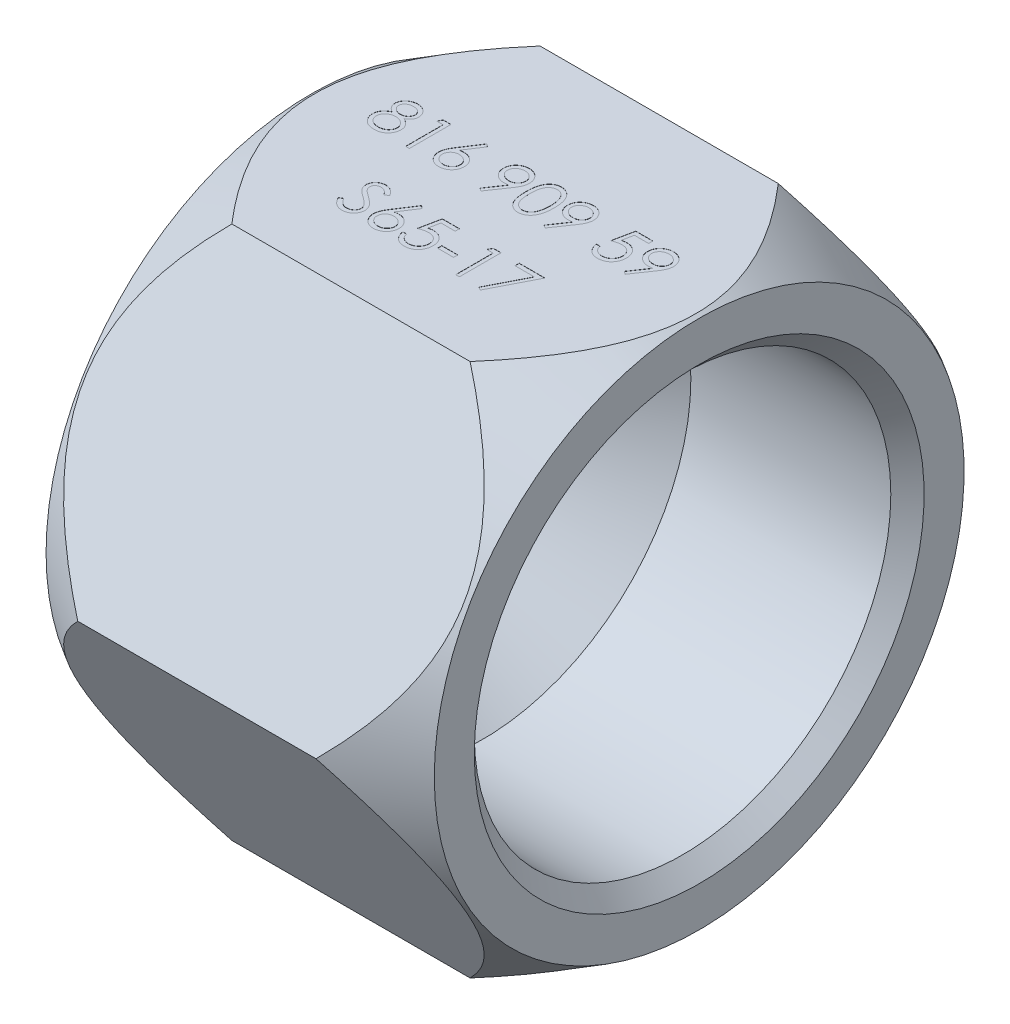
from build123d import *

# Parameters (mm, degrees)
SKETCH2_OUTSIDE_W  = 50.456
SKETCH2_OUTSIDE_H  = 50.456
EXTRUDE1_DEPTH     = 23.3
CHAMFER1_SIZE      = 1
SKETCH3_W          = 0.961538461
SKETCH3_H          = 0.256410256
CUT_EXTRUDE1_DEPTH = 0.01


with BuildPart() as part:
    # Sketch1 → Revolve1 (revolve)
    with BuildSketch(Plane.XY, mode=Mode.PRIVATE) as revolve1_sk:
        Polygon((0, 0), (0, 15.9), (4.5, 18.5), (18.8, 18.5), (23.3, 15.9), (23.3, 12.5), (10.3, 12.5), (3.3, 7.225121649), (3.3, 0), align=None)
    revolve(revolve1_sk.sketch.rotate(Axis((0, 0, 0), (1, 0, 0)), 90), axis=Axis((0, 0, 0), (1, 0, 0)))

    # Sketch2 outside → Extrude1 (cut)
    with BuildSketch(Plane(origin=(23.3, 0, 0), x_dir=(0, 0, -1), z_dir=(1, 0, 0))):
        Rectangle(SKETCH2_OUTSIDE_W, SKETCH2_OUTSIDE_H)
        Polygon((9.25, 16.02146997), (-9.25, 16.02146997), (-18.5, 0), (-9.25, -16.02146997), (9.25, -16.02146997), (18.5, 0), align=None, mode=Mode.SUBTRACT)
    extrude(amount=-EXTRUDE1_DEPTH, mode=Mode.SUBTRACT)

    # Chamfer1
    chamfer1_edges = [part.edges().sort_by_distance(p)[0] for p in [
        (23.3, 0, -12.5),
    ]]
    chamfer(chamfer1_edges, length=CHAMFER1_SIZE)

    # Sketch3 → Cut-Extrude1 (cut)
    # profile 1 of 14: a face of its own
    with BuildSketch(Plane(origin=(0, 16.02146997, 0), x_dir=(1, 0, 0), z_dir=(0, 1, 0))):
        with BuildLine():
            add(Edge.make_bspline(
                [(4.20263412, 1.392728365), (4.223097368, 1.382058397), (4.263007536, 1.361248395), (4.319848399, 1.327740661), (4.371794828, 1.292425686), (4.420288087, 1.256971501), (4.464476194, 1.220020321), (4.503865061, 1.181425209), (4.539427646, 1.142149534), (4.570446778, 1.10152822), (4.597730233, 1.059669185), (4.621310329, 1.016462561), (4.641465474, 0.972003037), (4.657439002, 0.925805301), (4.670597424, 0.878547972), (4.679651428, 0.829620842), (4.684520655, 0.779346312), (4.685441236, 0.745368954), (4.685907357, 0.728165064)],
                knots=[0, 0, 0, 0, 1.272397273, 2.481599622, 3.635517121, 4.734568067, 5.792894095, 6.808321871, 7.773003508, 8.711915296, 9.623354172, 10.525449501, 11.423591555, 12.311487226, 13.218079475, 14.126165749, 15.051214107, 16, 16, 16, 16], degree=3))
            add(Edge.make_bspline(
                [(4.685907357, 0.728165064), (4.685356343, 0.704095255), (4.684265678, 0.656452072), (4.674765689, 0.586133421), (4.660542133, 0.517839291), (4.639771053, 0.451584654), (4.612832917, 0.387735102), (4.579635177, 0.326235978), (4.542055745, 0.266079329), (4.511875574, 0.22906547), (4.496604473, 0.210336538)],
                knots=[0, 0, 0, 0, 1.025265484, 2.029385089, 3.018602448, 3.995076438, 4.983346944, 5.966715145, 6.97116228, 8, 8, 8, 8], degree=3))
            add(Edge.make_bspline(
                [(4.496604473, 0.210336538), (4.476721277, 0.188483843), (4.437200587, 0.145048491), (4.369498496, 0.088655055), (4.29519715, 0.041262631), (4.214584056, 0.002639849), (4.127874698, -0.027421479), (4.035087551, -0.049023277), (3.936041728, -0.061396441), (3.867966391, -0.063185005), (3.833042774, -0.064102564)],
                knots=[0, 0, 0, 0, 0.954267603, 1.896743057, 2.838368354, 3.796610408, 4.779680527, 5.799409237, 6.871065594, 8, 8, 8, 8], degree=3))
            add(Edge.make_bspline(
                [(3.833042774, -0.064102564), (3.799461782, -0.063279366), (3.734116583, -0.061677505), (3.639003813, -0.050824339), (3.550344478, -0.031804435), (3.467623072, -0.005772571), (3.391338291, 0.028091878), (3.321707504, 0.070240741), (3.257726095, 0.118977486), (3.201335757, 0.175701827), (3.151272583, 0.23645745), (3.107295402, 0.299137172), (3.070742489, 0.363746713), (3.039794564, 0.429322689), (3.016103119, 0.496784228), (2.999694397, 0.565784237), (2.989273459, 0.636202197), (2.987886934, 0.683724806), (2.987189409, 0.707632212)],
                knots=[0, 0, 0, 0, 1.256902934, 2.445805442, 3.576955095, 4.645999104, 5.686449165, 6.692658513, 7.68621702, 8.689161843, 9.678783111, 10.630372946, 11.551080876, 12.453998257, 13.34127905, 14.221779781, 15.105423033, 16, 16, 16, 16], degree=3))
            add(Edge.make_bspline(
                [(2.987189409, 0.707632212), (2.987602181, 0.725174492), (2.988417964, 0.759844229), (2.994064284, 0.811065177), (3.003141757, 0.860919559), (3.01546994, 0.909591519), (3.032177816, 0.956726714), (3.052350769, 1.002548481), (3.075873592, 1.047108551), (3.103074424, 1.090650609), (3.134718727, 1.132564547), (3.170549905, 1.173561686), (3.211284097, 1.213005876), (3.256468139, 1.251379037), (3.305585667, 1.289361876), (3.359912475, 1.324901682), (3.41800838, 1.360514514), (3.459297956, 1.381806175), (3.480478671, 1.392728365)],
                knots=[0, 0, 0, 0, 0.941657376, 1.861047343, 2.762797495, 3.66048619, 4.553285746, 5.444104102, 6.34607688, 7.256116206, 8.197091036, 9.162375105, 10.176350973, 11.237807142, 12.343728897, 13.50695164, 14.721116704, 16, 16, 16, 16], degree=3))
            add(Edge.make_bspline(
                [(3.480478671, 1.392728365), (3.451484832, 1.408538914), (3.395344645, 1.439152563), (3.32100933, 1.495400281), (3.257158884, 1.556320149), (3.205548372, 1.623198574), (3.164925352, 1.693946341), (3.13705492, 1.768120807), (3.118200288, 1.844346603), (3.116332555, 1.896422457), (3.115394537, 1.922576122)],
                knots=[0, 0, 0, 0, 1.166880483, 2.259407225, 3.286803203, 4.280235371, 5.237608625, 6.161067461, 7.076446754, 8, 8, 8, 8], degree=3))
            add(Edge.make_bspline(
                [(3.115394537, 1.922576122), (3.116562697, 1.949217235), (3.118910902, 2.002770518), (3.137898989, 2.082489178), (3.168841893, 2.160786724), (3.21092832, 2.237283662), (3.26334776, 2.309390958), (3.32623815, 2.374063063), (3.398097647, 2.430714122), (3.478567552, 2.478268531), (3.565164864, 2.516971144), (3.656533238, 2.543670018), (3.751080733, 2.561124387), (3.815436247, 2.563100569), (3.848066812, 2.564102564)],
                knots=[0, 0, 0, 0, 0.888701115, 1.786444228, 2.72001202, 3.692817113, 4.693886446, 5.687152267, 6.695133018, 7.739871481, 8.800368666, 9.853104506, 10.91144658, 12, 12, 12, 12], degree=3))
            add(Edge.make_bspline(
                [(3.848066812, 2.564102564), (3.879855252, 2.563069462), (3.942538433, 2.561032302), (4.034677452, 2.544041675), (4.122838079, 2.515663446), (4.206716293, 2.47716543), (4.284810484, 2.429746186), (4.353812133, 2.372316991), (4.414763977, 2.307930169), (4.465181402, 2.235844738), (4.506726323, 2.159641742), (4.535655538, 2.07991137), (4.554192662, 1.998376328), (4.556530779, 1.943206325), (4.557702229, 1.915564904)],
                knots=[0, 0, 0, 0, 1.072916533, 2.115669174, 3.151510826, 4.193348718, 5.225979165, 6.227137561, 7.216255879, 8.211077061, 9.189680878, 10.138522389, 11.067357538, 12, 12, 12, 12], degree=3))
            add(Edge.make_bspline(
                [(4.557702229, 1.915564904), (4.556677543, 1.888438715), (4.554665118, 1.835164423), (4.537736589, 1.757502623), (4.50922708, 1.684772595), (4.470302678, 1.616149058), (4.419570186, 1.552876559), (4.357706806, 1.494150509), (4.28520575, 1.439488489), (4.230733688, 1.408641086), (4.20263412, 1.392728365)],
                knots=[0, 0, 0, 0, 0.975232327, 1.915300861, 2.843280834, 3.77672583, 4.742871857, 5.749627742, 6.839139064, 8, 8, 8, 8], degree=3))
        make_face()
        with BuildLine():
            add(Edge.make_bspline(
                [(3.83554678, 2.307692308), (3.818010491, 2.307226993), (3.78370184, 2.306316634), (3.733395646, 2.301560465), (3.685558241, 2.292308167), (3.639689812, 2.279994802), (3.596419232, 2.263360524), (3.555158836, 2.243792661), (3.516610843, 2.220002614), (3.480309912, 2.193316044), (3.447630787, 2.163963968), (3.418627536, 2.13338274), (3.394536026, 2.100971746), (3.374078091, 2.067537203), (3.35923415, 2.032086792), (3.34811679, 1.99570738), (3.34060151, 1.957939249), (3.340038374, 1.932127455), (3.339753511, 1.919070513)],
                knots=[0, 0, 0, 0, 1.203892937, 2.355340988, 3.463153438, 4.544400666, 5.610487187, 6.640501085, 7.674077295, 8.714426146, 9.728707835, 10.68524104, 11.601827946, 12.495867327, 13.368432065, 14.231010473, 15.105153427, 16, 16, 16, 16], degree=3))
            add(Edge.make_bspline(
                [(3.339753511, 1.919070513), (3.340244488, 1.906013006), (3.341214727, 1.880209497), (3.34871839, 1.842105307), (3.359901858, 1.804661281), (3.377509473, 1.768767773), (3.398628301, 1.733179659), (3.424693641, 1.698786383), (3.455757232, 1.665468251), (3.490776832, 1.63350865), (3.528927931, 1.603580962), (3.569345104, 1.577600118), (3.611521098, 1.555861468), (3.655022576, 1.537769036), (3.700292896, 1.523704795), (3.747054663, 1.513727191), (3.795315736, 1.507525764), (3.828016151, 1.506785035), (3.844561204, 1.506410256)],
                knots=[0, 0, 0, 0, 0.873023192, 1.725219244, 2.590779336, 3.480155217, 4.391973325, 5.357036234, 6.360879153, 7.436073238, 8.526419356, 9.601555421, 10.645666583, 11.697338044, 12.750135903, 13.812665442, 14.89329948, 16, 16, 16, 16], degree=3))
            add(Edge.make_bspline(
                [(3.844561204, 1.506410256), (3.865811278, 1.507033733), (3.90810154, 1.508274528), (3.97044392, 1.519811081), (4.031060095, 1.537958165), (4.089302169, 1.562786712), (4.143662587, 1.593949469), (4.192119779, 1.631258768), (4.234260416, 1.673853123), (4.269646567, 1.721069434), (4.297082171, 1.771320569), (4.318440605, 1.821749349), (4.330912902, 1.8728938), (4.332539736, 1.907155917), (4.333343255, 1.924078526)],
                knots=[0, 0, 0, 0, 1.076279235, 2.141928126, 3.20205304, 4.278698113, 5.344010996, 6.36967002, 7.368914609, 8.37248503, 9.349703398, 10.264243087, 11.142681841, 12, 12, 12, 12], degree=3))
            add(Edge.make_bspline(
                [(4.333343255, 1.924078526), (4.332963328, 1.935955694), (4.332209228, 1.959530171), (4.325994902, 1.994343289), (4.31572645, 2.02836442), (4.30182425, 2.061874614), (4.283531539, 2.094403708), (4.261842834, 2.126463057), (4.235496761, 2.157331459), (4.20592788, 2.18772828), (4.172395446, 2.215859725), (4.13496408, 2.240598804), (4.093825687, 2.26160763), (4.048979294, 2.278671026), (4.000590062, 2.29148699), (3.948880866, 2.301084382), (3.893420547, 2.306493747), (3.855256439, 2.307284122), (3.83554678, 2.307692308)],
                knots=[0, 0, 0, 0, 0.814439003, 1.616544685, 2.417341072, 3.248991801, 4.09997495, 4.973547432, 5.9003056, 6.880240646, 7.880314356, 8.896779544, 9.951930927, 11.043077905, 12.18215768, 13.381699519, 14.647792085, 16, 16, 16, 16], degree=3))
        make_face(mode=Mode.SUBTRACT)
        with BuildLine():
            add(Edge.make_bspline(
                [(3.850070018, 1.25), (3.827837314, 1.249604542), (3.784222173, 1.24882875), (3.720324368, 1.240193392), (3.659000678, 1.228172397), (3.600457866, 1.209936084), (3.544720654, 1.186224305), (3.491487309, 1.157699634), (3.441165074, 1.12398146), (3.394448841, 1.085498163), (3.35178932, 1.044027125), (3.314361963, 1.0001256), (3.28257802, 0.954609505), (3.25698284, 0.906900769), (3.23597446, 0.858009619), (3.222178834, 0.806718479), (3.213334754, 0.754013399), (3.21214716, 0.718184757), (3.211548383, 0.700120192)],
                knots=[0, 0, 0, 0, 1.140299081, 2.23698856, 3.303958914, 4.344563908, 5.37730929, 6.408454204, 7.439741482, 8.480804886, 9.510774543, 10.48932336, 11.43758569, 12.353841022, 13.263987381, 14.161954604, 15.073269652, 16, 16, 16, 16], degree=3))
            add(Edge.make_bspline(
                [(3.211548383, 0.700120192), (3.212522139, 0.677669545), (3.214454049, 0.633127986), (3.22978022, 0.56729722), (3.254377031, 0.503567895), (3.288680756, 0.442459358), (3.331157594, 0.385352139), (3.383390785, 0.335574442), (3.442134241, 0.291344815), (3.509375565, 0.255573005), (3.582824469, 0.227005251), (3.662461419, 0.207322421), (3.747143503, 0.194292814), (3.805614641, 0.192979827), (3.83554678, 0.192307692)],
                knots=[0, 0, 0, 0, 0.898778495, 1.783155532, 2.693654817, 3.627872908, 4.583023416, 5.533784346, 6.509005473, 7.520592997, 8.575161974, 9.658835044, 10.801527049, 12, 12, 12, 12], degree=3))
            add(Edge.make_bspline(
                [(3.83554678, 0.192307692), (3.8589399, 0.192756841), (3.9045172, 0.193631927), (3.971007163, 0.201356423), (4.033753269, 0.213606155), (4.09263384, 0.231422973), (4.148308011, 0.253172957), (4.199831835, 0.281153015), (4.248530783, 0.312976103), (4.292005157, 0.350731929), (4.331600306, 0.391074425), (4.366124086, 0.433781599), (4.396093765, 0.477692765), (4.419615877, 0.523800254), (4.438420344, 0.571219479), (4.451937168, 0.620387701), (4.460277322, 0.671455724), (4.461120819, 0.706097918), (4.461548383, 0.723657853)],
                knots=[0, 0, 0, 0, 1.224942928, 2.386581632, 3.501229538, 4.569074225, 5.605009692, 6.626002462, 7.634866581, 8.645888296, 9.63523824, 10.59253846, 11.518950513, 12.414518923, 13.29783783, 14.186679152, 15.080837789, 16, 16, 16, 16], degree=3))
            add(Edge.make_bspline(
                [(4.461548383, 0.723657853), (4.460901348, 0.740713096), (4.459625509, 0.774343056), (4.451527872, 0.82417629), (4.437302246, 0.872321157), (4.417782677, 0.919356875), (4.391796275, 0.964330412), (4.361192796, 1.008413391), (4.324268426, 1.05038228), (4.282545143, 1.090563063), (4.237074456, 1.127717161), (4.188740782, 1.160584617), (4.137916166, 1.1882647), (4.084708158, 1.210776482), (4.029234904, 1.228481818), (3.971537205, 1.240850386), (3.911547509, 1.248635816), (3.870794029, 1.249540135), (3.850070018, 1.25)],
                knots=[0, 0, 0, 0, 0.917430815, 1.809013306, 2.70690318, 3.612392954, 4.541220862, 5.495268465, 6.494511384, 7.542276156, 8.608045339, 9.649016899, 10.681629292, 11.715607085, 12.752076957, 13.808767841, 14.885711793, 16, 16, 16, 16], degree=3))
        make_face(mode=Mode.SUBTRACT)
    # profile 2 of 14: a face of its own
    with BuildSketch(Plane(origin=(0, 16.02146997, 0), x_dir=(1, 0, 0), z_dir=(0, 1, 0))):
        Polygon((5.441616492, 2.5), (5.903856075, 2.5), (5.903856075, 0), (5.679497101, 0), (5.679497101, 2.243589744), (5.294881716, 2.243589744), align=None)
    # profile 3 of 14: a face of its own
    with BuildSketch(Plane(origin=(0, 16.02146997, 0), x_dir=(1, 0, 0), z_dir=(0, 1, 0))):
        with BuildLine():
            Line((7.987189409, 2.564102564), (8.159965851, 2.428385417))
            Line((8.159965851, 2.428385417), (7.49940896, 1.418269231))
            add(Edge.make_bspline(
                [(7.49940896, 1.418269231), (7.543387729, 1.425279131), (7.629173291, 1.438952735), (7.716006076, 1.44120841), (7.758323223, 1.442307692)],
                knots=[0, 0, 0, 0, 1.025318673, 2, 2, 2, 2], degree=3))
            add(Edge.make_bspline(
                [(7.758323223, 1.442307692), (7.783732149, 1.441624755), (7.833748863, 1.440280414), (7.907182293, 1.429934807), (7.977745819, 1.413631155), (8.045146971, 1.389865258), (8.109627672, 1.359506434), (8.171557955, 1.323121526), (8.229773677, 1.278831755), (8.285024519, 1.229356786), (8.335186731, 1.17455894), (8.379598199, 1.116415128), (8.416903051, 1.054985928), (8.447170138, 0.990302452), (8.470673622, 0.922464409), (8.487807654, 0.851558595), (8.497935935, 0.777536116), (8.499311286, 0.727194562), (8.500009921, 0.701622596)],
                knots=[0, 0, 0, 0, 1.04369286, 2.054478336, 3.041073146, 4.015093852, 4.984733326, 5.965804835, 6.960378782, 7.985147595, 9.009457201, 10.008161701, 10.986880575, 11.956520048, 12.937015923, 13.931873656, 14.949455224, 16, 16, 16, 16], degree=3))
            add(Edge.make_bspline(
                [(8.500009921, 0.701622596), (8.498993418, 0.666637093), (8.49699318, 0.597793903), (8.477061897, 0.497524827), (8.446090722, 0.402001602), (8.401821059, 0.312749337), (8.346833642, 0.229890358), (8.279778219, 0.156472169), (8.20303287, 0.090993571), (8.116256586, 0.036238843), (8.022868754, -0.008477622), (7.924760185, -0.040595652), (7.822883652, -0.060369559), (7.753737503, -0.062848561), (7.718759921, -0.064102564)],
                knots=[0, 0, 0, 0, 1.031375318, 2.029502543, 3.004789286, 3.987476834, 4.960371455, 5.9300674, 6.912260825, 7.929083631, 8.949397511, 9.960523116, 10.96833055, 12, 12, 12, 12], degree=3))
            add(Edge.make_bspline(
                [(7.718759921, -0.064102564), (7.685119421, -0.063010989), (7.61848348, -0.060848769), (7.520460055, -0.041587384), (7.426272186, -0.010368025), (7.336579771, 0.032642174), (7.253493619, 0.086969233), (7.179161021, 0.152370861), (7.113952611, 0.22744905), (7.059685024, 0.312192155), (7.016643073, 0.403256411), (6.984364555, 0.498211523), (6.965510096, 0.596711509), (6.962875412, 0.663483752), (6.961548383, 0.697115385)],
                knots=[0, 0, 0, 0, 1.012016664, 2.004627821, 2.994792927, 3.992885782, 4.990978636, 5.973936114, 6.964471063, 7.975201453, 8.993600317, 9.990122807, 10.98767138, 12, 12, 12, 12], degree=3))
            add(Edge.make_bspline(
                [(6.961548383, 0.697115385), (6.962392272, 0.722861515), (6.964115333, 0.775430195), (6.976146326, 0.855047358), (6.995478322, 0.936512417), (7.017128498, 1.005622555), (7.040003934, 1.062237928), (7.059041462, 1.107883278), (7.082737174, 1.154855473), (7.108003875, 1.204765213), (7.137115924, 1.256326237), (7.168769959, 1.310400286), (7.203841138, 1.366127378), (7.228426969, 1.40394466), (7.240995498, 1.423277244)],
                knots=[0, 0, 0, 0, 1.173818275, 2.396712641, 3.66331629, 4.989737886, 5.693666774, 6.447286557, 7.243889047, 8.091586357, 8.998013824, 9.943181721, 10.948533338, 12, 12, 12, 12], degree=3))
            Line((7.240995498, 1.423277244), (7.987189409, 2.564102564))
        make_face()
        with BuildLine():
            add(Edge.make_bspline(
                [(7.711247902, 1.185897436), (7.692203442, 1.18534169), (7.655004078, 1.184256158), (7.600427353, 1.177952407), (7.548775031, 1.166081646), (7.499362792, 1.150962837), (7.453114433, 1.130174937), (7.409693833, 1.104923652), (7.368933082, 1.075194239), (7.331259116, 1.041407874), (7.297102214, 1.004416422), (7.26768712, 0.964795335), (7.242313978, 0.923499475), (7.221684107, 0.880183802), (7.205619767, 0.834864874), (7.193999588, 0.787751125), (7.187532623, 0.73852662), (7.186456743, 0.705146261), (7.185907357, 0.688100962)],
                knots=[0, 0, 0, 0, 1.129588631, 2.206414736, 3.251139165, 4.268635594, 5.265702196, 6.250456724, 7.242448911, 8.251968645, 9.246821453, 10.222880186, 11.173611482, 12.116736599, 13.062300278, 14.020270554, 14.989073742, 16, 16, 16, 16], degree=3))
            add(Edge.make_bspline(
                [(7.185907357, 0.688100962), (7.186354758, 0.671208119), (7.187232045, 0.638083769), (7.195197988, 0.589270069), (7.207365904, 0.542295135), (7.225466187, 0.497401136), (7.247056821, 0.453903766), (7.275560624, 0.413378562), (7.307144043, 0.373364226), (7.344896852, 0.336934603), (7.38541354, 0.303037015), (7.428700113, 0.273408262), (7.47381437, 0.248060995), (7.521365386, 0.228195926), (7.570678517, 0.211892864), (7.622164628, 0.200420379), (7.675859524, 0.193934289), (7.712232337, 0.192857007), (7.730779152, 0.192307692)],
                knots=[0, 0, 0, 0, 0.989467248, 1.94019797, 2.891935182, 3.827694429, 4.772920941, 5.730924762, 6.725747692, 7.756678648, 8.79901574, 9.819492441, 10.826891316, 11.826466727, 12.835195252, 13.867842842, 14.912794438, 16, 16, 16, 16], degree=3))
            add(Edge.make_bspline(
                [(7.730779152, 0.192307692), (7.749325937, 0.19285705), (7.78569869, 0.193934416), (7.839394019, 0.200419894), (7.890878532, 0.211894642), (7.940197467, 0.228189478), (7.987727061, 0.248084914), (8.032801862, 0.273250571), (8.075679071, 0.303219226), (8.116222357, 0.336876675), (8.153818027, 0.373571569), (8.18615894, 0.413021371), (8.213789821, 0.454231296), (8.236242812, 0.497229789), (8.254143734, 0.54232228), (8.266373354, 0.589262797), (8.274322846, 0.638085673), (8.275202393, 0.671208762), (8.275650947, 0.688100962)],
                knots=[0, 0, 0, 0, 1.087397944, 2.132534446, 3.165364764, 4.174271784, 5.174024072, 6.181601208, 7.194203697, 8.236725232, 9.267838612, 10.269026844, 11.221737037, 12.171628256, 13.107553087, 14.05945871, 15.010357665, 16, 16, 16, 16], degree=3))
            add(Edge.make_bspline(
                [(8.275650947, 0.688100962), (8.275257881, 0.705168498), (8.274486419, 0.738666521), (8.265760742, 0.787729106), (8.253659046, 0.835104253), (8.235385453, 0.880494216), (8.211645063, 0.923719879), (8.182728344, 0.964999594), (8.149276508, 1.004649842), (8.110635409, 1.041480419), (8.068570956, 1.075156903), (8.023845538, 1.104885158), (7.977054128, 1.129974427), (7.928244169, 1.150908072), (7.876856396, 1.166014839), (7.823720439, 1.177910012), (7.768156694, 1.184240025), (7.730459117, 1.185337929), (7.711247902, 1.185897436)],
                knots=[0, 0, 0, 0, 0.978206639, 1.919901502, 2.851605144, 3.780102724, 4.718870031, 5.675451981, 6.667674623, 7.690630536, 8.733308323, 9.756129687, 10.767539656, 11.776269907, 12.797430371, 13.836405707, 14.897401972, 16, 16, 16, 16], degree=3))
        make_face(mode=Mode.SUBTRACT)
    # profile 4 of 14: a face of its own
    with BuildSketch(Plane(origin=(0, 16.02146997, 0), x_dir=(1, 0, 0), z_dir=(0, 1, 0))):
        with BuildLine():
            Line((10.262830434, -0.064102564), (10.083543575, 0.060596955))
            Line((10.083543575, 0.060596955), (10.778655755, 1.076722756))
            add(Edge.make_bspline(
                [(10.778655755, 1.076722756), (10.734305229, 1.07129914), (10.646976572, 1.060619736), (10.559021499, 1.05865784), (10.515735082, 1.057692308)],
                knots=[0, 0, 0, 0, 1.015715272, 2, 2, 2, 2], degree=3))
            add(Edge.make_bspline(
                [(10.515735082, 1.057692308), (10.489490762, 1.058364505), (10.437975457, 1.05968397), (10.362238562, 1.070142405), (10.289463162, 1.086249639), (10.219842193, 1.110284464), (10.153113976, 1.140154613), (10.08942418, 1.177195337), (10.028858544, 1.22077126), (9.972067537, 1.270651968), (9.920416295, 1.325422005), (9.874399654, 1.383390322), (9.836155988, 1.445230301), (9.804386999, 1.509680458), (9.780293817, 1.577667137), (9.762749148, 1.648416708), (9.751947466, 1.722425024), (9.750662398, 1.772800117), (9.750009921, 1.798377404)],
                knots=[0, 0, 0, 0, 1.060718605, 2.082097864, 3.085795603, 4.069760067, 5.054557537, 6.03741023, 7.043284206, 8.066802108, 9.088538119, 10.083643548, 11.053783639, 12.022749082, 12.983451788, 13.964007469, 14.966251758, 16, 16, 16, 16], degree=3))
            add(Edge.make_bspline(
                [(9.750009921, 1.798377404), (9.751248803, 1.833355013), (9.753680477, 1.902008964), (9.773250847, 2.002318799), (9.805436804, 2.09716633), (9.850314216, 2.186302183), (9.906839017, 2.26844414), (9.974773724, 2.342450289), (10.053705127, 2.407268042), (10.141835141, 2.46298524), (10.237087298, 2.507795952), (10.336850625, 2.540824024), (10.440360711, 2.560251701), (10.510480476, 2.56281303), (10.545783159, 2.564102564)],
                knots=[0, 0, 0, 0, 1.022988612, 2.007919123, 2.978103895, 3.94594894, 4.918897164, 5.887013414, 6.875921846, 7.89917871, 8.930658928, 9.948724884, 10.967259574, 12, 12, 12, 12], degree=3))
            add(Edge.make_bspline(
                [(10.545783159, 2.564102564), (10.580417744, 2.562795305), (10.64885242, 2.560212284), (10.749487425, 2.541295163), (10.845873866, 2.509411825), (10.937477428, 2.465351422), (11.022291294, 2.410122203), (11.09855973, 2.344311829), (11.164542258, 2.267879309), (11.220130744, 2.182673245), (11.264752202, 2.091125401), (11.296946689, 1.995565456), (11.316765003, 1.896680655), (11.31926238, 1.829684603), (11.320522742, 1.795873397)],
                knots=[0, 0, 0, 0, 1.026385292, 2.028040595, 3.023318987, 4.028184125, 5.03290303, 6.015178782, 7.004435299, 8.016004309, 9.023023918, 10.015172535, 10.998308025, 12, 12, 12, 12], degree=3))
            add(Edge.make_bspline(
                [(11.320522742, 1.795873397), (11.319681021, 1.769627849), (11.317973802, 1.71639532), (11.306019296, 1.635516504), (11.285719164, 1.55305134), (11.262682236, 1.4832502), (11.240444974, 1.425601308), (11.219515594, 1.380064465), (11.196292627, 1.332134991), (11.169207795, 1.282315464), (11.140091869, 1.229970796), (11.107192385, 1.175625999), (11.071259834, 1.119208147), (11.045667177, 1.081174513), (11.032562005, 1.061698718)],
                knots=[0, 0, 0, 0, 1.179839688, 2.393009684, 3.667231171, 4.993948276, 5.694988576, 6.444077775, 7.246288328, 8.089075292, 8.993003841, 9.939041771, 10.944649915, 12, 12, 12, 12], degree=3))
            Line((11.032562005, 1.061698718), (10.262830434, -0.064102564))
        make_face()
        with BuildLine():
            add(Edge.make_bspline(
                [(10.557301588, 1.314102564), (10.577183027, 1.314645695), (10.615885429, 1.315702987), (10.6725835, 1.32213816), (10.726100788, 1.33354815), (10.776580252, 1.349919373), (10.824528039, 1.369674137), (10.869182559, 1.394825555), (10.910581184, 1.424837437), (10.949001132, 1.458558877), (10.983118275, 1.49602358), (11.013506154, 1.535235799), (11.03933513, 1.576367663), (11.059737471, 1.619934279), (11.076512168, 1.664875142), (11.088096462, 1.711913967), (11.094513843, 1.760805682), (11.095607825, 1.794019009), (11.096163768, 1.810897436)],
                knots=[0, 0, 0, 0, 1.163407946, 2.26475976, 3.333800367, 4.359385343, 5.366239384, 6.363380779, 7.350133999, 8.353570782, 9.349036268, 10.310270964, 11.253520213, 12.184142, 13.120487599, 14.056272588, 15.012232024, 16, 16, 16, 16], degree=3))
            add(Edge.make_bspline(
                [(11.096163768, 1.810897436), (11.095685433, 1.827782911), (11.094742814, 1.861057811), (11.087180458, 1.910021911), (11.073876727, 1.956945669), (11.056026381, 2.002085976), (11.032511925, 2.045071956), (11.004295149, 2.086443293), (10.970771971, 2.12593767), (10.932198709, 2.162626229), (10.8906026, 2.196446157), (10.846273671, 2.226293355), (10.799577303, 2.251308495), (10.750798381, 2.271950616), (10.699835275, 2.288059027), (10.646718141, 2.299642859), (10.591178565, 2.306051255), (10.553477647, 2.307138323), (10.534264729, 2.307692308)],
                knots=[0, 0, 0, 0, 0.972161553, 1.915763587, 2.844109794, 3.775983486, 4.705125789, 5.659731448, 6.655561913, 7.682237399, 8.721216875, 9.739758359, 10.754845918, 11.767244016, 12.7857855, 13.828538656, 14.893392813, 16, 16, 16, 16], degree=3))
            add(Edge.make_bspline(
                [(10.534264729, 2.307692308), (10.515218905, 2.307137428), (10.477851156, 2.306048758), (10.422805328, 2.29965504), (10.370047351, 2.287981123), (10.319231908, 2.271958078), (10.270454436, 2.251306955), (10.223760269, 2.226292044), (10.179420972, 2.196453028), (10.137864743, 2.162599619), (10.09922337, 2.126108443), (10.066276563, 2.08627028), (10.037995212, 2.045093476), (10.014513067, 2.002080256), (9.996654126, 1.956947195), (9.983352696, 1.910021497), (9.975789721, 1.861057919), (9.974847188, 1.827782947), (9.974368896, 1.810897436)],
                knots=[0, 0, 0, 0, 1.099389452, 2.15699305, 3.192601482, 4.213358962, 5.227959689, 6.245255729, 7.266013209, 8.307253147, 9.336162325, 10.327954924, 11.284637477, 12.215801273, 13.149702402, 14.080068371, 15.025723358, 16, 16, 16, 16], degree=3))
            add(Edge.make_bspline(
                [(9.974368896, 1.810897436), (9.9748017, 1.794005865), (9.97565527, 1.760692597), (9.983889405, 1.711745173), (9.997659605, 1.664825035), (10.016102027, 1.619475958), (10.040388877, 1.576138917), (10.070191626, 1.535019372), (10.105124158, 1.495651194), (10.144719507, 1.458646042), (10.188053907, 1.424680203), (10.234337297, 1.395015644), (10.282772895, 1.369963898), (10.333531203, 1.34986291), (10.38623606, 1.333711721), (10.441361154, 1.322159189), (10.498724181, 1.315764713), (10.537588453, 1.314661929), (10.557301588, 1.314102564)],
                knots=[0, 0, 0, 0, 0.952633368, 1.87876736, 2.791047057, 3.707742249, 4.635551637, 5.587206343, 6.568248508, 7.601284464, 8.641511608, 9.671105535, 10.699146789, 11.713763218, 12.747829548, 13.806491675, 14.887386225, 16, 16, 16, 16], degree=3))
        make_face(mode=Mode.SUBTRACT)
    # profile 5 of 14: a face of its own
    with BuildSketch(Plane(origin=(0, 16.02146997, 0), x_dir=(1, 0, 0), z_dir=(0, 1, 0))):
        with BuildLine():
            add(Edge.make_bspline(
                [(11.641035562, 1.248998397), (11.641269861, 1.28906796), (11.64172499, 1.366903663), (11.646788148, 1.480321265), (11.655199106, 1.586721471), (11.666725801, 1.686109375), (11.68075293, 1.778510636), (11.699478278, 1.863678319), (11.720773137, 1.94200661), (11.745453455, 2.01375093), (11.773301876, 2.079877861), (11.803612062, 2.141610148), (11.837586915, 2.198854385), (11.87328471, 2.252524235), (11.912150476, 2.30174116), (11.953078183, 2.347200205), (11.997665237, 2.387850741), (12.044395958, 2.424883814), (12.093693432, 2.457347722), (12.144152479, 2.485942536), (12.196120412, 2.510371012), (12.249739114, 2.529578466), (12.304526656, 2.545443357), (12.36067456, 2.556292605), (12.418275535, 2.563118968), (12.457155131, 2.563771588), (12.476872902, 2.564102564)],
                knots=[0, 0, 0, 0, 1.646270934, 3.197905019, 4.663502075, 6.030701355, 7.308322542, 8.50163776, 9.611534131, 10.641858119, 11.616356847, 12.558055219, 13.465016945, 14.349605745, 15.204443733, 16.039544428, 16.859896111, 17.680448484, 18.487036065, 19.28249412, 20.06191084, 20.843045899, 21.620316918, 22.403196591, 23.190181807, 24, 24, 24, 24], degree=3))
            add(Edge.make_bspline(
                [(12.476872902, 2.564102564), (12.496755387, 2.563754125), (12.536295393, 2.563061188), (12.594752804, 2.556401229), (12.65185972, 2.545350427), (12.707372676, 2.529692588), (12.761747666, 2.510267105), (12.814559386, 2.485919164), (12.866135873, 2.457577116), (12.915657507, 2.424274346), (12.963667946, 2.387144149), (13.00898792, 2.345170814), (13.051621553, 2.298778158), (13.092103914, 2.248462541), (13.129286483, 2.193258909), (13.164696077, 2.134127402), (13.196390389, 2.070033927), (13.226915157, 2.002047878), (13.253263005, 1.928288122), (13.277024608, 1.849170436), (13.296223872, 1.763760302), (13.312216209, 1.672505842), (13.32460542, 1.575071925), (13.333628736, 1.471667414), (13.338395225, 1.362224278), (13.339292869, 1.287397243), (13.339753511, 1.248998397)],
                knots=[0, 0, 0, 0, 0.810914788, 1.612654377, 2.396697861, 3.181598691, 3.963628158, 4.749916497, 5.551656086, 6.361998678, 7.18212741, 8.025565596, 8.878627764, 9.750805457, 10.657531673, 11.591944965, 12.560506719, 13.57287815, 14.630710178, 15.753379473, 16.941251878, 18.199788006, 19.531962791, 20.947069417, 22.433333509, 24, 24, 24, 24], degree=3))
            add(Edge.make_bspline(
                [(13.339753511, 1.248998397), (13.339288094, 1.210767035), (13.338381247, 1.136274783), (13.33368217, 1.027324087), (13.324426005, 0.924468341), (13.312847442, 0.827460868), (13.29681104, 0.736705426), (13.277093064, 0.651887963), (13.255199976, 0.572642198), (13.228175123, 0.499617332), (13.198596045, 0.431794673), (13.166413762, 0.368460996), (13.131935314, 0.309056501), (13.094371925, 0.254056682), (13.054333773, 0.203071926), (13.010963924, 0.157002196), (12.965484934, 0.11473743), (12.917333209, 0.077129125), (12.867039244, 0.044211407), (12.815639903, 0.014772943), (12.762223201, -0.008964696), (12.707999663, -0.029346869), (12.652193687, -0.04491862), (12.594874837, -0.05568566), (12.536334668, -0.06323698), (12.496762122, -0.063813037), (12.476872902, -0.064102564)],
                knots=[0, 0, 0, 0, 1.561518951, 3.042555995, 4.452378317, 5.7783523, 7.031515105, 8.214008947, 9.334062868, 10.386615937, 11.391082383, 12.354592575, 13.286541444, 14.194233754, 15.072674879, 15.931287219, 16.775624067, 17.606195743, 18.42308326, 19.229000347, 20.022332153, 20.807536673, 21.593273796, 22.3848459, 23.188221202, 24, 24, 24, 24], degree=3))
            add(Edge.make_bspline(
                [(12.476872902, -0.064102564), (12.457155678, -0.063769453), (12.41827716, -0.063112623), (12.360668285, -0.056317101), (12.304752254, -0.045391741), (12.250253144, -0.030094167), (12.196891347, -0.011369284), (12.145394, 0.013026205), (12.095188511, 0.041121968), (12.046408829, 0.073118698), (11.999971571, 0.109777043), (11.955615424, 0.150322963), (11.914454696, 0.195768257), (11.876144628, 0.245395345), (11.839734565, 0.298747661), (11.806242155, 0.356553642), (11.775262974, 0.418584078), (11.746946195, 0.485239728), (11.721840007, 0.557493248), (11.699663072, 0.636171233), (11.68215296, 0.721968116), (11.667165134, 0.814194807), (11.655076289, 0.913247614), (11.6468232, 1.019180313), (11.641722261, 1.13192689), (11.641268639, 1.209262444), (11.641035562, 1.248998397)],
                knots=[0, 0, 0, 0, 0.810891512, 1.598919785, 2.382837074, 3.152667961, 3.926044502, 4.706494248, 5.493654104, 6.291793342, 7.103789334, 7.925228297, 8.761435821, 9.622817696, 10.50288917, 11.416980706, 12.369136599, 13.353924996, 14.394355917, 15.514179734, 16.714354668, 17.994756427, 19.357759367, 20.818452758, 22.365282078, 24, 24, 24, 24], degree=3))
        make_face()
        with BuildLine():
            add(Edge.make_bspline(
                [(11.865394537, 1.25), (11.865479856, 1.216608072), (11.865645444, 1.151800897), (11.869971302, 1.05762714), (11.875864325, 0.96979119), (11.883465251, 0.888181522), (11.894753072, 0.81307437), (11.907400777, 0.743953168), (11.92279227, 0.681183712), (11.941002997, 0.624335276), (11.961745209, 0.572443084), (11.984392254, 0.524156502), (12.008721342, 0.478905119), (12.035949307, 0.437095399), (12.065602923, 0.398590996), (12.097012394, 0.362710401), (12.131349954, 0.330712558), (12.178852628, 0.292336233), (12.241564395, 0.252679708), (12.320579006, 0.218146787), (12.401770757, 0.196445033), (12.456878792, 0.193685207), (12.484384921, 0.192307692)],
                knots=[0, 0, 0, 0, 1.459021318, 2.831673884, 4.118529203, 5.306027144, 6.411944654, 7.436330062, 8.375795394, 9.233974572, 10.042671642, 10.816086306, 11.563610507, 12.285937304, 12.993564865, 13.685989202, 14.367179055, 15.041617293, 16.353048772, 17.594441528, 18.799311195, 20, 20, 20, 20], degree=3))
            add(Edge.make_bspline(
                [(12.484384921, 0.192307692), (12.512068973, 0.193448964), (12.567379918, 0.195729152), (12.648189771, 0.21772825), (12.726639964, 0.250920778), (12.788119922, 0.290168997), (12.834893167, 0.327546375), (12.868405303, 0.359413981), (12.899163909, 0.395096743), (12.92833682, 0.43359624), (12.955093302, 0.475648014), (12.979424115, 0.521049854), (13.001626506, 0.569927838), (13.014275824, 0.60404908), (13.020743095, 0.621494391)],
                knots=[0, 0, 0, 0, 1.353760809, 2.704726607, 4.075137775, 5.516104923, 6.260822281, 7.007110065, 7.778089737, 8.566572457, 9.372053459, 10.217411131, 11.088608312, 12, 12, 12, 12], degree=3))
            add(Edge.make_bspline(
                [(13.020743095, 0.621494391), (13.028280072, 0.643801348), (13.043583367, 0.689094037), (13.063306063, 0.759353788), (13.078838491, 0.833070048), (13.092812324, 0.909802274), (13.102350221, 0.990116346), (13.11002723, 1.073763763), (13.11454915, 1.160807594), (13.115109686, 1.219946873), (13.115394537, 1.25)],
                knots=[0, 0, 0, 0, 0.884706709, 1.796334032, 2.740027952, 3.714592787, 4.726048262, 5.777819803, 6.87074269, 8, 8, 8, 8], degree=3))
            add(Edge.make_bspline(
                [(13.115394537, 1.25), (13.115001545, 1.280048266), (13.114232768, 1.338829098), (13.111294205, 1.424913513), (13.103705937, 1.506676199), (13.095277995, 1.584469394), (13.082851409, 1.657862467), (13.069452975, 1.727469828), (13.051452109, 1.792429132), (13.032223699, 1.853757404), (13.010216273, 1.910757872), (12.985990749, 1.963696291), (12.960118064, 2.012828237), (12.932016464, 2.058018909), (12.902019547, 2.099470726), (12.869335584, 2.136352579), (12.835261032, 2.169807556), (12.78753447, 2.207995106), (12.725052835, 2.246932031), (12.647305944, 2.282764717), (12.566398341, 2.303342068), (12.511703016, 2.306243274), (12.484384921, 2.307692308)],
                knots=[0, 0, 0, 0, 1.31362396, 2.569729283, 3.763502607, 4.902122613, 5.988968491, 7.01645872, 7.998833611, 8.933434873, 9.825090667, 10.667526885, 11.477055099, 12.250526234, 12.991942729, 13.710640831, 14.402115721, 15.076753259, 16.378508321, 17.609869233, 18.806226677, 20, 20, 20, 20], degree=3))
            add(Edge.make_bspline(
                [(12.484384921, 2.307692308), (12.456734499, 2.306241274), (12.40138328, 2.303336564), (12.319634741, 2.282841383), (12.24127449, 2.247117836), (12.17895808, 2.207866141), (12.131198232, 2.170481633), (12.097567737, 2.138062738), (12.066034757, 2.102601127), (12.036986399, 2.063742617), (12.009779768, 2.02198164), (11.984793331, 1.976989665), (11.962280953, 1.928538691), (11.941506284, 1.876669808), (11.923240007, 1.819826277), (11.90817289, 1.757134138), (11.894253566, 1.688232787), (11.884399803, 1.612718853), (11.875639977, 1.531088743), (11.870010443, 1.443033516), (11.865630974, 1.348701816), (11.865474928, 1.28355956), (11.865394537, 1.25)],
                knots=[0, 0, 0, 0, 1.207732386, 2.417664972, 3.655092373, 4.956220595, 5.625982001, 6.301752483, 6.994047911, 7.697131622, 8.419323945, 9.170223765, 9.943494443, 10.752040957, 11.610060368, 12.549350801, 13.567764191, 14.679664412, 15.874934091, 17.154273443, 18.533957287, 20, 20, 20, 20], degree=3))
        make_face(mode=Mode.SUBTRACT)
    # profile 6 of 14: a face of its own
    with BuildSketch(Plane(origin=(0, 16.02146997, 0), x_dir=(1, 0, 0), z_dir=(0, 1, 0))):
        with BuildLine():
            Line((14.10898428, -0.064102564), (13.929697421, 0.060596955))
            Line((13.929697421, 0.060596955), (14.624809601, 1.076722756))
            add(Edge.make_bspline(
                [(14.624809601, 1.076722756), (14.580459076, 1.07129914), (14.493130418, 1.060619736), (14.405175345, 1.05865784), (14.361888928, 1.057692308)],
                knots=[0, 0, 0, 0, 1.015715272, 2, 2, 2, 2], degree=3))
            add(Edge.make_bspline(
                [(14.361888928, 1.057692308), (14.335644608, 1.058364505), (14.284129303, 1.05968397), (14.208392408, 1.070142405), (14.135617008, 1.086249639), (14.06599604, 1.110284464), (13.999267822, 1.140154613), (13.935578027, 1.177195337), (13.87501239, 1.22077126), (13.818221383, 1.270651968), (13.766570141, 1.325422005), (13.7205535, 1.383390322), (13.682309834, 1.445230301), (13.650540845, 1.509680458), (13.626447664, 1.577667137), (13.608902994, 1.648416708), (13.598101312, 1.722425024), (13.596816244, 1.772800117), (13.596163768, 1.798377404)],
                knots=[0, 0, 0, 0, 1.060718605, 2.082097864, 3.085795603, 4.069760067, 5.054557537, 6.03741023, 7.043284206, 8.066802108, 9.088538119, 10.083643548, 11.053783639, 12.022749082, 12.983451788, 13.964007469, 14.966251758, 16, 16, 16, 16], degree=3))
            add(Edge.make_bspline(
                [(13.596163768, 1.798377404), (13.59740265, 1.833355013), (13.599834324, 1.902008964), (13.619404693, 2.002318799), (13.65159065, 2.09716633), (13.696468062, 2.186302183), (13.752992863, 2.26844414), (13.82092757, 2.342450289), (13.899858973, 2.407268042), (13.987988987, 2.46298524), (14.083241144, 2.507795952), (14.183004472, 2.540824024), (14.286514557, 2.560251701), (14.356634322, 2.56281303), (14.391937005, 2.564102564)],
                knots=[0, 0, 0, 0, 1.022988612, 2.007919123, 2.978103895, 3.94594894, 4.918897164, 5.887013414, 6.875921846, 7.89917871, 8.930658928, 9.948724884, 10.967259574, 12, 12, 12, 12], degree=3))
            add(Edge.make_bspline(
                [(14.391937005, 2.564102564), (14.42657159, 2.562795305), (14.495006267, 2.560212284), (14.595641271, 2.541295163), (14.692027712, 2.509411825), (14.783631274, 2.465351422), (14.86844514, 2.410122203), (14.944713576, 2.344311829), (15.010696104, 2.267879309), (15.06628459, 2.182673245), (15.110906048, 2.091125401), (15.143100536, 1.995565456), (15.162918849, 1.896680655), (15.165416226, 1.829684603), (15.166676588, 1.795873397)],
                knots=[0, 0, 0, 0, 1.026385292, 2.028040595, 3.023318987, 4.028184125, 5.03290303, 6.015178782, 7.004435299, 8.016004309, 9.023023918, 10.015172535, 10.998308025, 12, 12, 12, 12], degree=3))
            add(Edge.make_bspline(
                [(15.166676588, 1.795873397), (15.165834867, 1.769627849), (15.164127648, 1.71639532), (15.152173143, 1.635516504), (15.13187301, 1.55305134), (15.108836083, 1.4832502), (15.08659882, 1.425601308), (15.06566944, 1.380064465), (15.042446473, 1.332134991), (15.015361641, 1.282315464), (14.986245715, 1.229970796), (14.953346231, 1.175625999), (14.91741368, 1.119208147), (14.891821023, 1.081174513), (14.878715851, 1.061698718)],
                knots=[0, 0, 0, 0, 1.179839688, 2.393009684, 3.667231171, 4.993948276, 5.694988576, 6.444077775, 7.246288328, 8.089075292, 8.993003841, 9.939041771, 10.944649915, 12, 12, 12, 12], degree=3))
            Line((14.878715851, 1.061698718), (14.10898428, -0.064102564))
        make_face()
        with BuildLine():
            add(Edge.make_bspline(
                [(14.403455434, 1.314102564), (14.423336873, 1.314645695), (14.462039275, 1.315702987), (14.518737346, 1.32213816), (14.572254634, 1.33354815), (14.622734098, 1.349919373), (14.670681885, 1.369674137), (14.715336405, 1.394825555), (14.75673503, 1.424837437), (14.795154978, 1.458558877), (14.829272121, 1.49602358), (14.85966, 1.535235799), (14.885488977, 1.576367663), (14.905891317, 1.619934279), (14.922666014, 1.664875142), (14.934250308, 1.711913967), (14.940667689, 1.760805682), (14.941761671, 1.794019009), (14.942317614, 1.810897436)],
                knots=[0, 0, 0, 0, 1.163407946, 2.26475976, 3.333800367, 4.359385343, 5.366239384, 6.363380779, 7.350133999, 8.353570782, 9.349036268, 10.310270964, 11.253520213, 12.184142, 13.120487599, 14.056272588, 15.012232024, 16, 16, 16, 16], degree=3))
            add(Edge.make_bspline(
                [(14.942317614, 1.810897436), (14.941839279, 1.827782911), (14.940896661, 1.861057811), (14.933334304, 1.910021911), (14.920030573, 1.956945669), (14.902180227, 2.002085976), (14.878665771, 2.045071956), (14.850448996, 2.086443293), (14.816925817, 2.12593767), (14.778352556, 2.162626229), (14.736756446, 2.196446157), (14.692427518, 2.226293355), (14.645731149, 2.251308495), (14.596952228, 2.271950616), (14.545989121, 2.288059027), (14.492871987, 2.299642859), (14.437332411, 2.306051255), (14.399631493, 2.307138323), (14.380418575, 2.307692308)],
                knots=[0, 0, 0, 0, 0.972161553, 1.915763587, 2.844109794, 3.775983486, 4.705125789, 5.659731448, 6.655561913, 7.682237399, 8.721216875, 9.739758359, 10.754845918, 11.767244016, 12.7857855, 13.828538656, 14.893392813, 16, 16, 16, 16], degree=3))
            add(Edge.make_bspline(
                [(14.380418575, 2.307692308), (14.361372751, 2.307137428), (14.324005002, 2.306048758), (14.268959174, 2.29965504), (14.216201197, 2.287981123), (14.165385754, 2.271958078), (14.116608282, 2.251306955), (14.069914116, 2.226292044), (14.025574818, 2.196453028), (13.984018589, 2.162599619), (13.945377216, 2.126108443), (13.91243041, 2.08627028), (13.884149058, 2.045093476), (13.860666913, 2.002080256), (13.842807972, 1.956947195), (13.829506543, 1.910021497), (13.821943567, 1.861057919), (13.821001034, 1.827782947), (13.820522742, 1.810897436)],
                knots=[0, 0, 0, 0, 1.099389452, 2.15699305, 3.192601482, 4.213358962, 5.227959689, 6.245255729, 7.266013209, 8.307253147, 9.336162325, 10.327954924, 11.284637477, 12.215801273, 13.149702402, 14.080068371, 15.025723358, 16, 16, 16, 16], degree=3))
            add(Edge.make_bspline(
                [(13.820522742, 1.810897436), (13.820955546, 1.794005865), (13.821809116, 1.760692597), (13.830043251, 1.711745173), (13.843813451, 1.664825035), (13.862255873, 1.619475958), (13.886542723, 1.576138917), (13.916345472, 1.535019372), (13.951278005, 1.495651194), (13.990873353, 1.458646042), (14.034207754, 1.424680203), (14.080491144, 1.395015644), (14.128926741, 1.369963898), (14.179685049, 1.34986291), (14.232389906, 1.333711721), (14.287515, 1.322159189), (14.344878027, 1.315764713), (14.3837423, 1.314661929), (14.403455434, 1.314102564)],
                knots=[0, 0, 0, 0, 0.952633368, 1.87876736, 2.791047057, 3.707742249, 4.635551637, 5.587206343, 6.568248508, 7.601284464, 8.641511608, 9.671105535, 10.699146789, 11.713763218, 12.747829548, 13.806491675, 14.887386225, 16, 16, 16, 16], degree=3))
        make_face(mode=Mode.SUBTRACT)
    # profile 7 of 14: a face of its own
    with BuildSketch(Plane(origin=(0, 16.02146997, 0), x_dir=(1, 0, 0), z_dir=(0, 1, 0))):
        with BuildLine():
            Line((18.019240691, 2.5), (18.019240691, 2.243589744))
            Line((18.019240691, 2.243589744), (17.168880114, 2.243589744))
            Line((17.168880114, 2.243589744), (17.034164569, 1.58603766))
            add(Edge.make_bspline(
                [(17.034164569, 1.58603766), (17.060633051, 1.593344997), (17.111911548, 1.607501807), (17.187597163, 1.623220214), (17.259448737, 1.632695532), (17.306074001, 1.633989325), (17.328635723, 1.634615385)],
                knots=[0, 0, 0, 0, 1.100273476, 2.13160584, 3.095893838, 4, 4, 4, 4], degree=3))
            add(Edge.make_bspline(
                [(17.328635723, 1.634615385), (17.35655268, 1.634011145), (17.411444392, 1.632823058), (17.491757926, 1.621414595), (17.568424278, 1.603457513), (17.641283114, 1.578371426), (17.710469221, 1.546293045), (17.775346051, 1.506221659), (17.836887417, 1.459412137), (17.89398927, 1.405594271), (17.945792348, 1.346364545), (17.991339483, 1.282680351), (18.030027047, 1.215160592), (18.061141872, 1.143160158), (18.085987825, 1.067475048), (18.102524965, 0.987308918), (18.1135369, 0.903417403), (18.114767176, 0.846056996), (18.115394537, 0.816806891)],
                knots=[0, 0, 0, 0, 1.052922333, 2.070308379, 3.05430497, 4.020497103, 4.973039431, 5.925935799, 6.892292201, 7.88610001, 8.88166317, 9.857072816, 10.836096531, 11.812156883, 12.81219415, 13.836441305, 14.89672472, 16, 16, 16, 16], degree=3))
            add(Edge.make_bspline(
                [(18.115394537, 0.816806891), (18.114919483, 0.796433876), (18.113975795, 0.755963171), (18.109176804, 0.695860171), (18.099937007, 0.637029576), (18.08753149, 0.579463581), (18.071429763, 0.523271173), (18.051937581, 0.46829151), (18.028083276, 0.414866791), (18.001918008, 0.362491509), (17.972456238, 0.312349718), (17.939757304, 0.265457584), (17.905210525, 0.221111669), (17.868038107, 0.179787574), (17.827894539, 0.141756847), (17.785265991, 0.106793789), (17.74049262, 0.074307124), (17.692881733, 0.045615556), (17.643494245, 0.019213445), (17.591616947, -0.002446225), (17.538430732, -0.021810888), (17.483170107, -0.037246264), (17.425960241, -0.049340946), (17.36670683, -0.057555661), (17.305720637, -0.063538831), (17.264381342, -0.063913371), (17.243499505, -0.064102564)],
                knots=[0, 0, 0, 0, 1.056347294, 2.098418968, 3.122841568, 4.141288669, 5.149314143, 6.15115421, 7.162517403, 8.180376062, 9.185164535, 10.17417709, 11.141909838, 12.097768115, 13.052685741, 14.0056014, 14.954263652, 15.917497458, 16.885230207, 17.854509472, 18.828990115, 19.81800267, 20.826176721, 21.857883937, 22.917946725, 24, 24, 24, 24], degree=3))
            add(Edge.make_bspline(
                [(17.243499505, -0.064102564), (17.218589376, -0.063609108), (17.16958164, -0.062638293), (17.097781234, -0.052482232), (17.028699373, -0.037936577), (16.962892158, -0.016053527), (16.899769827, 0.011365969), (16.840182171, 0.046020377), (16.782606617, 0.085291166), (16.729383734, 0.131634275), (16.67998651, 0.182288333), (16.635767575, 0.237258077), (16.596386449, 0.29563625), (16.562473772, 0.35770636), (16.533546614, 0.423305311), (16.510821622, 0.492678883), (16.49247994, 0.5654646), (16.484720354, 0.61557425), (16.480779152, 0.641025641)],
                knots=[0, 0, 0, 0, 1.0467383, 2.05933395, 3.04377827, 4.011590433, 4.970194871, 5.932262533, 6.905835911, 7.896367577, 8.894135286, 9.877477877, 10.858688626, 11.851381753, 12.8477658, 13.868841284, 14.917554742, 16, 16, 16, 16], degree=3))
            Line((16.480779152, 0.641025641), (16.705138127, 0.641025641))
            add(Edge.make_bspline(
                [(16.705138127, 0.641025641), (16.710658525, 0.617185318), (16.721269036, 0.571362893), (16.744558857, 0.506983363), (16.773034482, 0.449612489), (16.806894731, 0.398491358), (16.84728761, 0.353913503), (16.893380059, 0.31418703), (16.945057005, 0.278347652), (17.00248074, 0.248474247), (17.063061511, 0.222996566), (17.126466661, 0.20603107), (17.190969765, 0.194101861), (17.234597173, 0.192907746), (17.256520338, 0.192307692)],
                knots=[0, 0, 0, 0, 1.136247022, 2.183929868, 3.172523383, 4.106158343, 5.02341133, 5.958108904, 6.928429099, 7.938127109, 8.96079061, 9.975095812, 10.982467395, 12, 12, 12, 12], degree=3))
            add(Edge.make_bspline(
                [(17.256520338, 0.192307692), (17.277919227, 0.192893962), (17.320053814, 0.194048333), (17.382061948, 0.202933341), (17.441928286, 0.216617321), (17.499062113, 0.237095789), (17.554463212, 0.261984873), (17.606730191, 0.293924213), (17.657375103, 0.330681369), (17.70482377, 0.372793248), (17.74828052, 0.419200172), (17.786677749, 0.468826882), (17.818661259, 0.521767487), (17.845614194, 0.577105453), (17.866080836, 0.635447279), (17.880681536, 0.696519547), (17.88925515, 0.760473105), (17.890434564, 0.80409404), (17.891035562, 0.826322115)],
                knots=[0, 0, 0, 0, 1.027316725, 2.022795036, 3.002884548, 3.971462791, 4.93288096, 5.914575861, 6.907176829, 7.935150275, 8.956128384, 9.956726525, 10.942570165, 11.921478529, 12.907843606, 13.90538589, 14.932640048, 16, 16, 16, 16], degree=3))
            add(Edge.make_bspline(
                [(17.891035562, 0.826322115), (17.89056522, 0.846376224), (17.889644592, 0.885629287), (17.882122756, 0.943057292), (17.869039204, 0.997395179), (17.85087929, 1.048905346), (17.827822498, 1.097636377), (17.799646561, 1.143638562), (17.765822705, 1.186305586), (17.727185642, 1.22565741), (17.68485847, 1.261975178), (17.63811294, 1.29293524), (17.587927278, 1.318980895), (17.534906135, 1.341458037), (17.47778835, 1.357601426), (17.417705042, 1.369721345), (17.354007393, 1.376732318), (17.310456902, 1.377705095), (17.288070819, 1.378205128)],
                knots=[0, 0, 0, 0, 1.045622112, 2.046656509, 3.013763289, 3.955457236, 4.890082067, 5.820317437, 6.762574623, 7.722996705, 8.69280354, 9.665887285, 10.63943826, 11.638615906, 12.663482002, 13.728887084, 14.832589034, 16, 16, 16, 16], degree=3))
            add(Edge.make_bspline(
                [(17.288070819, 1.378205128), (17.268693013, 1.37779042), (17.228682759, 1.376934153), (17.167309311, 1.370629513), (17.102815223, 1.360458588), (17.035447726, 1.346468412), (16.965004506, 1.3281605), (16.89163422, 1.306221571), (16.815182601, 1.279991571), (16.763669941, 1.260182847), (16.737189409, 1.25)],
                knots=[0, 0, 0, 0, 0.817624296, 1.688186739, 2.600797293, 3.572016777, 4.590301741, 5.671205678, 6.80286297, 8, 8, 8, 8], degree=3))
            Line((16.737189409, 1.25), (16.993599665, 2.5))
            Line((16.993599665, 2.5), (18.019240691, 2.5))
        make_face()
    # profile 8 of 14: a face of its own
    with BuildSketch(Plane(origin=(0, 16.02146997, 0), x_dir=(1, 0, 0), z_dir=(0, 1, 0))):
        with BuildLine():
            Line((18.916676588, -0.064102564), (18.737389729, 0.060596955))
            Line((18.737389729, 0.060596955), (19.432501909, 1.076722756))
            add(Edge.make_bspline(
                [(19.432501909, 1.076722756), (19.388151383, 1.07129914), (19.300822726, 1.060619736), (19.212867653, 1.05865784), (19.169581236, 1.057692308)],
                knots=[0, 0, 0, 0, 1.015715272, 2, 2, 2, 2], degree=3))
            add(Edge.make_bspline(
                [(19.169581236, 1.057692308), (19.143336916, 1.058364505), (19.091821611, 1.05968397), (19.016084716, 1.070142405), (18.943309316, 1.086249639), (18.873688347, 1.110284464), (18.806960129, 1.140154613), (18.743270334, 1.177195337), (18.682704698, 1.22077126), (18.625913691, 1.270651968), (18.574262449, 1.325422005), (18.528245808, 1.383390322), (18.490002142, 1.445230301), (18.458233152, 1.509680458), (18.434139971, 1.577667137), (18.416595302, 1.648416708), (18.40579362, 1.722425024), (18.404508552, 1.772800117), (18.403856075, 1.798377404)],
                knots=[0, 0, 0, 0, 1.060718605, 2.082097864, 3.085795603, 4.069760067, 5.054557537, 6.03741023, 7.043284206, 8.066802108, 9.088538119, 10.083643548, 11.053783639, 12.022749082, 12.983451788, 13.964007469, 14.966251758, 16, 16, 16, 16], degree=3))
            add(Edge.make_bspline(
                [(18.403856075, 1.798377404), (18.405094957, 1.833355013), (18.407526631, 1.902008964), (18.427097001, 2.002318799), (18.459282957, 2.09716633), (18.504160369, 2.186302183), (18.56068517, 2.26844414), (18.628619878, 2.342450289), (18.707551281, 2.407268042), (18.795681294, 2.46298524), (18.890933452, 2.507795952), (18.990696779, 2.540824024), (19.094206865, 2.560251701), (19.164326629, 2.56281303), (19.199629312, 2.564102564)],
                knots=[0, 0, 0, 0, 1.022988612, 2.007919123, 2.978103895, 3.94594894, 4.918897164, 5.887013414, 6.875921846, 7.89917871, 8.930658928, 9.948724884, 10.967259574, 12, 12, 12, 12], degree=3))
            add(Edge.make_bspline(
                [(19.199629312, 2.564102564), (19.234263898, 2.562795305), (19.302698574, 2.560212284), (19.403333579, 2.541295163), (19.49972002, 2.509411825), (19.591323582, 2.465351422), (19.676137447, 2.410122203), (19.752405884, 2.344311829), (19.818388412, 2.267879309), (19.873976898, 2.182673245), (19.918598355, 2.091125401), (19.950792843, 1.995565456), (19.970611157, 1.896680655), (19.973108533, 1.829684603), (19.974368896, 1.795873397)],
                knots=[0, 0, 0, 0, 1.026385292, 2.028040595, 3.023318987, 4.028184125, 5.03290303, 6.015178782, 7.004435299, 8.016004309, 9.023023918, 10.015172535, 10.998308025, 12, 12, 12, 12], degree=3))
            add(Edge.make_bspline(
                [(19.974368896, 1.795873397), (19.973527175, 1.769627849), (19.971819955, 1.71639532), (19.95986545, 1.635516504), (19.939565318, 1.55305134), (19.91652839, 1.4832502), (19.894291128, 1.425601308), (19.873361748, 1.380064465), (19.850138781, 1.332134991), (19.823053949, 1.282315464), (19.793938022, 1.229970796), (19.761038539, 1.175625999), (19.725105988, 1.119208147), (19.699513331, 1.081174513), (19.686408159, 1.061698718)],
                knots=[0, 0, 0, 0, 1.179839688, 2.393009684, 3.667231171, 4.993948276, 5.694988576, 6.444077775, 7.246288328, 8.089075292, 8.993003841, 9.939041771, 10.944649915, 12, 12, 12, 12], degree=3))
            Line((19.686408159, 1.061698718), (18.916676588, -0.064102564))
        make_face()
        with BuildLine():
            add(Edge.make_bspline(
                [(19.211147742, 1.314102564), (19.231029181, 1.314645695), (19.269731583, 1.315702987), (19.326429654, 1.32213816), (19.379946942, 1.33354815), (19.430426406, 1.349919373), (19.478374193, 1.369674137), (19.523028713, 1.394825555), (19.564427338, 1.424837437), (19.602847286, 1.458558877), (19.636964428, 1.49602358), (19.667352308, 1.535235799), (19.693181284, 1.576367663), (19.713583625, 1.619934279), (19.730358322, 1.664875142), (19.741942616, 1.711913967), (19.748359997, 1.760805682), (19.749453979, 1.794019009), (19.750009921, 1.810897436)],
                knots=[0, 0, 0, 0, 1.163407946, 2.26475976, 3.333800367, 4.359385343, 5.366239384, 6.363380779, 7.350133999, 8.353570782, 9.349036268, 10.310270964, 11.253520213, 12.184142, 13.120487599, 14.056272588, 15.012232024, 16, 16, 16, 16], degree=3))
            add(Edge.make_bspline(
                [(19.750009921, 1.810897436), (19.749531586, 1.827782911), (19.748588968, 1.861057811), (19.741026611, 1.910021911), (19.727722881, 1.956945669), (19.709872534, 2.002085976), (19.686358079, 2.045071956), (19.658141303, 2.086443293), (19.624618125, 2.12593767), (19.586044863, 2.162626229), (19.544448754, 2.196446157), (19.500119825, 2.226293355), (19.453423457, 2.251308495), (19.404644535, 2.271950616), (19.353681429, 2.288059027), (19.300564295, 2.299642859), (19.245024719, 2.306051255), (19.2073238, 2.307138323), (19.188110883, 2.307692308)],
                knots=[0, 0, 0, 0, 0.972161553, 1.915763587, 2.844109794, 3.775983486, 4.705125789, 5.659731448, 6.655561913, 7.682237399, 8.721216875, 9.739758359, 10.754845918, 11.767244016, 12.7857855, 13.828538656, 14.893392813, 16, 16, 16, 16], degree=3))
            add(Edge.make_bspline(
                [(19.188110883, 2.307692308), (19.169065059, 2.307137428), (19.13169731, 2.306048758), (19.076651482, 2.29965504), (19.023893504, 2.287981123), (18.973078061, 2.271958078), (18.92430059, 2.251306955), (18.877606423, 2.226292044), (18.833267126, 2.196453028), (18.791710897, 2.162599619), (18.753069524, 2.126108443), (18.720122717, 2.08627028), (18.691841366, 2.045093476), (18.668359221, 2.002080256), (18.65050028, 1.956947195), (18.63719885, 1.910021497), (18.629635875, 1.861057919), (18.628693342, 1.827782947), (18.62821505, 1.810897436)],
                knots=[0, 0, 0, 0, 1.099389452, 2.15699305, 3.192601482, 4.213358962, 5.227959689, 6.245255729, 7.266013209, 8.307253147, 9.336162325, 10.327954924, 11.284637477, 12.215801273, 13.149702402, 14.080068371, 15.025723358, 16, 16, 16, 16], degree=3))
            add(Edge.make_bspline(
                [(18.62821505, 1.810897436), (18.628647854, 1.794005865), (18.629501423, 1.760692597), (18.637735559, 1.711745173), (18.651505759, 1.664825035), (18.669948181, 1.619475958), (18.694235031, 1.576138917), (18.724037779, 1.535019372), (18.758970312, 1.495651194), (18.798565661, 1.458646042), (18.841900061, 1.424680203), (18.888183451, 1.395015644), (18.936619049, 1.369963898), (18.987377357, 1.34986291), (19.040082214, 1.333711721), (19.095207308, 1.322159189), (19.152570334, 1.315764713), (19.191434607, 1.314661929), (19.211147742, 1.314102564)],
                knots=[0, 0, 0, 0, 0.952633368, 1.87876736, 2.791047057, 3.707742249, 4.635551637, 5.587206343, 6.568248508, 7.601284464, 8.641511608, 9.671105535, 10.699146789, 11.713763218, 12.747829548, 13.806491675, 14.887386225, 16, 16, 16, 16], degree=3))
        make_face(mode=Mode.SUBTRACT)
    # profile 9 of 14: a face of its own
    with BuildSketch(Plane(origin=(0, 16.02146997, 0), x_dir=(1, 0, 0), z_dir=(0, 1, 0))):
        with BuildLine():
            Line((6.320522742, -4.684395032), (6.531860883, -4.557692308))
            add(Edge.make_bspline(
                [(6.531860883, -4.557692308), (6.551516767, -4.59059544), (6.589176681, -4.653636571), (6.651999081, -4.738820886), (6.717094017, -4.811222426), (6.784943541, -4.870420003), (6.855133504, -4.917026351), (6.928122114, -4.950027945), (7.003663408, -4.970610784), (7.05507328, -4.973110846), (7.080739088, -4.974358974)],
                knots=[0, 0, 0, 0, 1.272034388, 2.437168799, 3.508375237, 4.49857839, 5.41946034, 6.295179144, 7.148887113, 8, 8, 8, 8], degree=3))
            add(Edge.make_bspline(
                [(7.080739088, -4.974358974), (7.102658274, -4.973748494), (7.146113112, -4.972538215), (7.210086143, -4.960909071), (7.272216002, -4.943043265), (7.331222171, -4.917456885), (7.386290467, -4.886500824), (7.434580964, -4.849110697), (7.476328188, -4.807249121), (7.510477555, -4.760547225), (7.536677581, -4.71032069), (7.556814772, -4.65876644), (7.567989825, -4.605074605), (7.56967322, -4.568924274), (7.570522742, -4.55068109)],
                knots=[0, 0, 0, 0, 1.095163259, 2.171163733, 3.241058638, 4.321873601, 5.38011039, 6.391990106, 7.366004449, 8.327778327, 9.272591725, 10.192022065, 11.087607919, 12, 12, 12, 12], degree=3))
            add(Edge.make_bspline(
                [(7.570522742, -4.55068109), (7.569469663, -4.529866197), (7.567328907, -4.487552562), (7.549234993, -4.425124238), (7.520771245, -4.363343831), (7.494512214, -4.325128642), (7.480879312, -4.305288462)],
                knots=[0, 0, 0, 0, 0.938893495, 1.908633276, 2.914225137, 4, 4, 4, 4], degree=3))
            add(Edge.make_bspline(
                [(7.480879312, -4.305288462), (7.469686017, -4.290969302), (7.446187092, -4.260908017), (7.405788869, -4.21616142), (7.358384502, -4.170005407), (7.305596248, -4.120677509), (7.245501185, -4.07047194), (7.179981531, -4.016994599), (7.107364489, -3.962279186), (7.056436277, -3.925584497), (7.030158159, -3.906650641)],
                knots=[0, 0, 0, 0, 0.722233717, 1.516239348, 2.393582979, 3.351407094, 4.387010283, 5.505090956, 6.712668013, 8, 8, 8, 8], degree=3))
            add(Edge.make_bspline(
                [(7.030158159, -3.906650641), (7.003855304, -3.887915936), (6.95356625, -3.852096605), (6.883238691, -3.798936403), (6.820349789, -3.750333639), (6.765179062, -3.705830773), (6.717750779, -3.665421769), (6.6776912, -3.62949467), (6.646020802, -3.597077841), (6.628409673, -3.576048311), (6.62050271, -3.566606571)],
                knots=[0, 0, 0, 0, 1.452282411, 2.77665338, 3.964542531, 5.026858415, 5.96415736, 6.766646006, 7.446254459, 8, 8, 8, 8], degree=3))
            add(Edge.make_bspline(
                [(6.62050271, -3.566606571), (6.609450892, -3.551891544), (6.587716009, -3.52295247), (6.559026005, -3.477720429), (6.534640888, -3.431418096), (6.515524937, -3.38392105), (6.499427638, -3.335896101), (6.488600544, -3.28671664), (6.481820975, -3.236603341), (6.481126699, -3.202879412), (6.480779152, -3.185997596)],
                knots=[0, 0, 0, 0, 1.068054152, 2.10047183, 3.106115577, 4.101338837, 5.06977816, 6.043150881, 7.020423561, 8, 8, 8, 8], degree=3))
            add(Edge.make_bspline(
                [(6.480779152, -3.185997596), (6.481711444, -3.159547757), (6.483556102, -3.107213426), (6.499156471, -3.030762833), (6.523779967, -2.957772535), (6.558276315, -2.888965154), (6.602745853, -2.82613231), (6.654207263, -2.768551248), (6.715501182, -2.720145118), (6.782753056, -2.67785079), (6.85636475, -2.644746558), (6.933501109, -2.619774429), (7.014284732, -2.60562496), (7.069001257, -2.603594413), (7.096764729, -2.602564103)],
                knots=[0, 0, 0, 0, 1.005424448, 1.989358655, 2.955360095, 3.929531133, 4.905563448, 5.876582895, 6.856512386, 7.866279853, 8.892233794, 9.918561126, 10.94386622, 12, 12, 12, 12], degree=3))
            add(Edge.make_bspline(
                [(7.096764729, -2.602564103), (7.126224801, -2.603580211), (7.184811481, -2.605600926), (7.270989492, -2.623170591), (7.353961432, -2.6522425), (7.420706621, -2.685234398), (7.472944308, -2.718185409), (7.512781974, -2.74819957), (7.553151582, -2.782753219), (7.594378764, -2.821938394), (7.635764949, -2.866114645), (7.677924558, -2.914979423), (7.720956179, -2.968234106), (7.748638936, -3.006251606), (7.762830434, -3.025741186)],
                knots=[0, 0, 0, 0, 1.286793592, 2.559021753, 3.825965368, 5.121522368, 5.803751409, 6.523245864, 7.299691795, 8.125521123, 9.008227632, 9.944561021, 10.946284179, 12, 12, 12, 12], degree=3))
            Line((7.762830434, -3.025741186), (7.560005915, -3.179487179))
            add(Edge.make_bspline(
                [(7.560005915, -3.179487179), (7.54775882, -3.163709543), (7.52417378, -3.133325505), (7.488367003, -3.090774566), (7.454617969, -3.051905652), (7.421367684, -3.018144846), (7.390372233, -2.987643322), (7.360288631, -2.96152921), (7.331549809, -2.939546642), (7.295323444, -2.916086956), (7.249810788, -2.892832311), (7.192678976, -2.873154398), (7.132974494, -2.861329354), (7.092310472, -2.859765863), (7.071724665, -2.858974359)],
                knots=[0, 0, 0, 0, 1.181633172, 2.275549214, 3.290209073, 4.226197932, 5.078386478, 5.862611352, 6.581680152, 7.217281963, 8.414376989, 9.595101626, 10.782541182, 12, 12, 12, 12], degree=3))
            add(Edge.make_bspline(
                [(7.071724665, -2.858974359), (7.045898578, -2.859839859), (6.996095401, -2.861508894), (6.925388089, -2.879737455), (6.861749571, -2.908438784), (6.807069168, -2.948663768), (6.761542756, -2.99632162), (6.728610285, -3.051163659), (6.708788739, -3.111722518), (6.706369968, -3.153966559), (6.705138127, -3.175480769)],
                knots=[0, 0, 0, 0, 1.14458467, 2.207223713, 3.21896685, 4.227309161, 5.202851033, 6.127160689, 7.046193047, 8, 8, 8, 8], degree=3))
            add(Edge.make_bspline(
                [(6.705138127, -3.175480769), (6.705418931, -3.188874682), (6.705981, -3.215684411), (6.713820141, -3.255292569), (6.72389109, -3.294800669), (6.739850113, -3.334031085), (6.761882473, -3.373669913), (6.790814741, -3.414399726), (6.827252821, -3.456579517), (6.855164973, -3.484013356), (6.869901748, -3.498497596)],
                knots=[0, 0, 0, 0, 0.858281714, 1.717966888, 2.583508476, 3.4729293, 4.427298488, 5.488583878, 6.674047936, 8, 8, 8, 8], degree=3))
            add(Edge.make_bspline(
                [(6.869901748, -3.498497596), (6.875374157, -3.503381186), (6.888375348, -3.514983478), (6.912143866, -3.533977964), (6.943531579, -3.557408515), (6.981718866, -3.586399456), (7.027409839, -3.620029072), (7.080609522, -3.657867366), (7.140724902, -3.701142694), (7.183383414, -3.73139808), (7.205939409, -3.747395833)],
                knots=[0, 0, 0, 0, 0.420754252, 0.999615792, 1.744751191, 2.668019286, 3.750313428, 4.999500688, 6.413464383, 8, 8, 8, 8], degree=3))
            add(Edge.make_bspline(
                [(7.205939409, -3.747395833), (7.233072204, -3.767139662), (7.285611101, -3.805370849), (7.360366516, -3.86281062), (7.428147807, -3.918987598), (7.489192952, -3.973543031), (7.54410503, -4.026063098), (7.59227483, -4.077179655), (7.634193173, -4.126526493), (7.679321187, -4.189792618), (7.725433915, -4.267493393), (7.765034992, -4.362692134), (7.79000524, -4.458260935), (7.793270608, -4.522494389), (7.794881716, -4.554186699)],
                knots=[0, 0, 0, 0, 1.163667725, 2.253281268, 3.268753668, 4.215851969, 5.092017293, 5.902905408, 6.650798638, 7.335211899, 8.59617414, 9.77448103, 10.901945474, 12, 12, 12, 12], degree=3))
            add(Edge.make_bspline(
                [(7.794881716, -4.554186699), (7.794412332, -4.576599817), (7.793482678, -4.620990805), (7.782796311, -4.686173003), (7.767139408, -4.749480767), (7.743541383, -4.810131561), (7.714739128, -4.869234963), (7.678191808, -4.925240606), (7.635829176, -4.979388034), (7.587233629, -5.030233385), (7.534057985, -5.076909239), (7.477855346, -5.118429997), (7.418533722, -5.153050228), (7.356414925, -5.18130083), (7.291484684, -5.2033962), (7.223764838, -5.219405392), (7.153143759, -5.2292309), (7.105143415, -5.230250729), (7.080739088, -5.230769231)],
                knots=[0, 0, 0, 0, 0.983748083, 1.948392443, 2.894712957, 3.844097841, 4.80183111, 5.778335162, 6.776009319, 7.81870978, 8.863265674, 9.881300176, 10.883814829, 11.87499822, 12.874611388, 13.892143829, 14.928324115, 16, 16, 16, 16], degree=3))
            add(Edge.make_bspline(
                [(7.080739088, -5.230769231), (7.0618567, -5.230404101), (7.024329729, -5.22967844), (6.968822956, -5.22326324), (6.914437535, -5.214186737), (6.861855905, -5.199776687), (6.810400611, -5.182293132), (6.760295444, -5.160765752), (6.711516119, -5.134967751), (6.663789275, -5.105471305), (6.617236293, -5.071144344), (6.572293816, -5.031163275), (6.527487255, -4.986630772), (6.484139114, -4.936337512), (6.441372583, -4.881096024), (6.400030862, -4.820389465), (6.359258206, -4.754548498), (6.333675729, -4.708216294), (6.320522742, -4.684395032)],
                knots=[0, 0, 0, 0, 0.915332311, 1.819136955, 2.706846663, 3.586547465, 4.459518054, 5.340707479, 6.227863349, 7.133153174, 8.059268498, 9.028702269, 10.047606654, 11.120612155, 12.245963614, 13.433783089, 14.680604001, 16, 16, 16, 16], degree=3))
        make_face()
    # profile 10 of 14: a face of its own
    with BuildSketch(Plane(origin=(0, 16.02146997, 0), x_dir=(1, 0, 0), z_dir=(0, 1, 0))):
        with BuildLine():
            Line((9.237189409, -2.602564103), (9.409965851, -2.73828125))
            Line((9.409965851, -2.73828125), (8.74940896, -3.748397436))
            add(Edge.make_bspline(
                [(8.74940896, -3.748397436), (8.793387729, -3.741387535), (8.879173291, -3.727713932), (8.966006076, -3.725458257), (9.008323223, -3.724358974)],
                knots=[0, 0, 0, 0, 1.025318673, 2, 2, 2, 2], degree=3))
            add(Edge.make_bspline(
                [(9.008323223, -3.724358974), (9.033732149, -3.725041911), (9.083748863, -3.726386252), (9.157182293, -3.73673186), (9.227745819, -3.753035511), (9.295146971, -3.776801408), (9.359627672, -3.807160233), (9.421557955, -3.84354514), (9.479773677, -3.887834912), (9.535024519, -3.93730988), (9.585186731, -3.992107726), (9.629598199, -4.050251538), (9.666903051, -4.111680739), (9.697170138, -4.176364215), (9.720673622, -4.244202257), (9.737807654, -4.315108071), (9.747935935, -4.389130551), (9.749311286, -4.439472105), (9.750009921, -4.465044071)],
                knots=[0, 0, 0, 0, 1.04369286, 2.054478336, 3.041073146, 4.015093852, 4.984733326, 5.965804835, 6.960378782, 7.985147595, 9.009457201, 10.008161701, 10.986880575, 11.956520048, 12.937015923, 13.931873656, 14.949455224, 16, 16, 16, 16], degree=3))
            add(Edge.make_bspline(
                [(9.750009921, -4.465044071), (9.748993418, -4.500029573), (9.74699318, -4.568872763), (9.727061897, -4.669141839), (9.696090722, -4.764665065), (9.651821059, -4.85391733), (9.596833642, -4.936776308), (9.529778219, -5.010194498), (9.45303287, -5.075673096), (9.366256586, -5.130427824), (9.272868754, -5.175144289), (9.174760185, -5.207262319), (9.072883652, -5.227036226), (9.003737503, -5.229515228), (8.968759921, -5.230769231)],
                knots=[0, 0, 0, 0, 1.031375318, 2.029502543, 3.004789286, 3.987476834, 4.960371455, 5.9300674, 6.912260825, 7.929083631, 8.949397511, 9.960523116, 10.96833055, 12, 12, 12, 12], degree=3))
            add(Edge.make_bspline(
                [(8.968759921, -5.230769231), (8.935119421, -5.229677655), (8.86848348, -5.227515435), (8.770460055, -5.208254051), (8.676272186, -5.177034692), (8.586579771, -5.134024493), (8.503493619, -5.079697434), (8.429161021, -5.014295806), (8.363952611, -4.939217616), (8.309685024, -4.854474511), (8.266643073, -4.763410256), (8.234364555, -4.668455144), (8.215510096, -4.569955157), (8.212875412, -4.503182915), (8.211548383, -4.469551282)],
                knots=[0, 0, 0, 0, 1.012016664, 2.004627821, 2.994792927, 3.992885782, 4.990978636, 5.973936114, 6.964471063, 7.975201453, 8.993600317, 9.990122807, 10.98767138, 12, 12, 12, 12], degree=3))
            add(Edge.make_bspline(
                [(8.211548383, -4.469551282), (8.212392272, -4.443805151), (8.214115333, -4.391236471), (8.226146326, -4.311619308), (8.245478322, -4.23015425), (8.267128498, -4.161044112), (8.290003934, -4.104428739), (8.309041462, -4.058783388), (8.332737174, -4.011811193), (8.358003875, -3.961901453), (8.387115924, -3.91034043), (8.418769959, -3.85626638), (8.453841138, -3.800539289), (8.478426969, -3.762722007), (8.490995498, -3.743389423)],
                knots=[0, 0, 0, 0, 1.173818275, 2.396712641, 3.66331629, 4.989737886, 5.693666774, 6.447286557, 7.243889047, 8.091586357, 8.998013824, 9.943181721, 10.948533338, 12, 12, 12, 12], degree=3))
            Line((8.490995498, -3.743389423), (9.237189409, -2.602564103))
        make_face()
        with BuildLine():
            add(Edge.make_bspline(
                [(8.961247902, -3.980769231), (8.942203442, -3.981324976), (8.905004078, -3.982410509), (8.850427353, -3.98871426), (8.798775031, -4.000585021), (8.749362792, -4.01570383), (8.703114433, -4.036491729), (8.659693833, -4.061743014), (8.618933082, -4.091472427), (8.581259116, -4.125258792), (8.547102214, -4.162250245), (8.51768712, -4.201871332), (8.492313978, -4.243167191), (8.471684107, -4.286482864), (8.455619767, -4.331801793), (8.443999588, -4.378915542), (8.437532623, -4.428140046), (8.436456743, -4.461520406), (8.435907357, -4.478565705)],
                knots=[0, 0, 0, 0, 1.129588631, 2.206414736, 3.251139165, 4.268635594, 5.265702196, 6.250456724, 7.242448911, 8.251968645, 9.246821453, 10.222880186, 11.173611482, 12.116736599, 13.062300278, 14.020270554, 14.989073742, 16, 16, 16, 16], degree=3))
            add(Edge.make_bspline(
                [(8.435907357, -4.478565705), (8.436354758, -4.495458548), (8.437232045, -4.528582898), (8.445197988, -4.577396597), (8.457365904, -4.624371532), (8.475466187, -4.669265531), (8.497056821, -4.712762901), (8.525560624, -4.753288105), (8.557144043, -4.793302441), (8.594896852, -4.829732063), (8.63541354, -4.863629652), (8.678700113, -4.893258404), (8.72381437, -4.918605671), (8.771365386, -4.938470741), (8.820678517, -4.954773803), (8.872164628, -4.966246288), (8.925859524, -4.972732378), (8.962232337, -4.973809659), (8.980779152, -4.974358974)],
                knots=[0, 0, 0, 0, 0.989467248, 1.94019797, 2.891935182, 3.827694429, 4.772920941, 5.730924762, 6.725747692, 7.756678648, 8.79901574, 9.819492441, 10.826891316, 11.826466727, 12.835195252, 13.867842842, 14.912794438, 16, 16, 16, 16], degree=3))
            add(Edge.make_bspline(
                [(8.980779152, -4.974358974), (8.999325937, -4.973809616), (9.03569869, -4.972732251), (9.089394019, -4.966246773), (9.140878532, -4.954772024), (9.190197467, -4.938477188), (9.237727061, -4.918581753), (9.282801862, -4.893416096), (9.325679071, -4.863447441), (9.366222357, -4.829789992), (9.403818027, -4.793095098), (9.43615894, -4.753645296), (9.463789821, -4.712435371), (9.486242812, -4.669436878), (9.504143734, -4.624344387), (9.516373354, -4.57740387), (9.524322846, -4.528580994), (9.525202393, -4.495457905), (9.525650947, -4.478565705)],
                knots=[0, 0, 0, 0, 1.087397944, 2.132534446, 3.165364764, 4.174271784, 5.174024072, 6.181601208, 7.194203697, 8.236725232, 9.267838612, 10.269026844, 11.221737037, 12.171628256, 13.107553087, 14.05945871, 15.010357665, 16, 16, 16, 16], degree=3))
            add(Edge.make_bspline(
                [(9.525650947, -4.478565705), (9.525257881, -4.461498169), (9.524486419, -4.428000146), (9.515760742, -4.378937561), (9.503659046, -4.331562414), (9.485385453, -4.28617245), (9.461645063, -4.242946788), (9.432728344, -4.201667073), (9.399276508, -4.162016825), (9.360635409, -4.125186247), (9.318570956, -4.091509763), (9.273845538, -4.061781509), (9.227054128, -4.03669224), (9.178244169, -4.015758595), (9.126856396, -4.000651828), (9.073720439, -3.988756654), (9.018156694, -3.982426642), (8.980459117, -3.981328738), (8.961247902, -3.980769231)],
                knots=[0, 0, 0, 0, 0.978206639, 1.919901502, 2.851605144, 3.780102724, 4.718870031, 5.675451981, 6.667674623, 7.690630536, 8.733308323, 9.756129687, 10.767539656, 11.776269907, 12.797430371, 13.836405707, 14.897401972, 16, 16, 16, 16], degree=3))
        make_face(mode=Mode.SUBTRACT)
    # profile 11 of 14: a face of its own
    with BuildSketch(Plane(origin=(0, 16.02146997, 0), x_dir=(1, 0, 0), z_dir=(0, 1, 0))):
        with BuildLine():
            Line((11.576932998, -2.666666667), (11.576932998, -2.923076923))
            Line((11.576932998, -2.923076923), (10.726572421, -2.923076923))
            Line((10.726572421, -2.923076923), (10.591856877, -3.580629006))
            add(Edge.make_bspline(
                [(10.591856877, -3.580629006), (10.618325358, -3.573321669), (10.669603855, -3.55916486), (10.74528947, -3.543446452), (10.817141044, -3.533971135), (10.863766309, -3.532677342), (10.88632803, -3.532051282)],
                knots=[0, 0, 0, 0, 1.100273476, 2.13160584, 3.095893838, 4, 4, 4, 4], degree=3))
            add(Edge.make_bspline(
                [(10.88632803, -3.532051282), (10.914244987, -3.532655522), (10.9691367, -3.533843608), (11.049450233, -3.545252072), (11.126116586, -3.563209154), (11.198975421, -3.588295241), (11.268161529, -3.620373622), (11.333038359, -3.660445008), (11.394579725, -3.70725453), (11.451681578, -3.761072396), (11.503484655, -3.820302122), (11.549031791, -3.883986316), (11.587719355, -3.951506074), (11.61883418, -4.023506509), (11.643680133, -4.099191619), (11.660217272, -4.179357749), (11.671229207, -4.263249263), (11.672459483, -4.32060967), (11.673086845, -4.349859776)],
                knots=[0, 0, 0, 0, 1.052922333, 2.070308379, 3.05430497, 4.020497103, 4.973039431, 5.925935799, 6.892292201, 7.88610001, 8.88166317, 9.857072816, 10.836096531, 11.812156883, 12.81219415, 13.836441305, 14.89672472, 16, 16, 16, 16], degree=3))
            add(Edge.make_bspline(
                [(11.673086845, -4.349859776), (11.672611791, -4.37023279), (11.671668103, -4.410703496), (11.666869112, -4.470806496), (11.657629315, -4.529637091), (11.645223798, -4.587203085), (11.62912207, -4.643395494), (11.609629889, -4.698375157), (11.585775584, -4.751799876), (11.559610316, -4.804175158), (11.530148546, -4.854316949), (11.497449612, -4.901209082), (11.462902832, -4.945554998), (11.425730414, -4.986879093), (11.385586846, -5.02490982), (11.342958299, -5.059872878), (11.298184928, -5.092359542), (11.25057404, -5.12105111), (11.201186553, -5.147453222), (11.149309255, -5.169112891), (11.09612304, -5.188477554), (11.040862415, -5.203912931), (10.983652548, -5.216007613), (10.924399137, -5.224222328), (10.863412945, -5.230205497), (10.82207365, -5.230580038), (10.801191812, -5.230769231)],
                knots=[0, 0, 0, 0, 1.056347294, 2.098418968, 3.122841568, 4.141288669, 5.149314143, 6.15115421, 7.162517403, 8.180376062, 9.185164535, 10.17417709, 11.141909838, 12.097768115, 13.052685741, 14.0056014, 14.954263652, 15.917497458, 16.885230207, 17.854509472, 18.828990115, 19.81800267, 20.826176721, 21.857883937, 22.917946725, 24, 24, 24, 24], degree=3))
            add(Edge.make_bspline(
                [(10.801191812, -5.230769231), (10.776281683, -5.230275775), (10.727273947, -5.229304959), (10.655473542, -5.219148898), (10.586391681, -5.204603244), (10.520584466, -5.182720194), (10.457462135, -5.155300698), (10.397874479, -5.120646289), (10.340298925, -5.081375501), (10.287076041, -5.035032392), (10.237678817, -4.984378333), (10.193459883, -4.92940859), (10.154078756, -4.871030417), (10.12016608, -4.808960307), (10.091238922, -4.743361356), (10.06851393, -4.673987784), (10.050172248, -4.601202067), (10.042412662, -4.551092416), (10.03847146, -4.525641026)],
                knots=[0, 0, 0, 0, 1.0467383, 2.05933395, 3.04377827, 4.011590433, 4.970194871, 5.932262533, 6.905835911, 7.896367577, 8.894135286, 9.877477877, 10.858688626, 11.851381753, 12.8477658, 13.868841284, 14.917554742, 16, 16, 16, 16], degree=3))
            Line((10.03847146, -4.525641026), (10.262830434, -4.525641026))
            add(Edge.make_bspline(
                [(10.262830434, -4.525641026), (10.268350832, -4.549481349), (10.278961344, -4.595303774), (10.302251165, -4.659683303), (10.33072679, -4.717054177), (10.364587039, -4.768175308), (10.404979918, -4.812753163), (10.451072367, -4.852479636), (10.502749312, -4.888319014), (10.560173048, -4.918192419), (10.620753819, -4.9436701), (10.684158969, -4.960635597), (10.748662073, -4.972564806), (10.79228948, -4.973758921), (10.814212646, -4.974358974)],
                knots=[0, 0, 0, 0, 1.136247022, 2.183929868, 3.172523383, 4.106158343, 5.02341133, 5.958108904, 6.928429099, 7.938127109, 8.96079061, 9.975095812, 10.982467395, 12, 12, 12, 12], degree=3))
            add(Edge.make_bspline(
                [(10.814212646, -4.974358974), (10.835611535, -4.973772704), (10.877746122, -4.972618334), (10.939754255, -4.963733325), (10.999620594, -4.950049346), (11.05675442, -4.929570878), (11.11215552, -4.904681794), (11.164422499, -4.872742454), (11.215067411, -4.835985298), (11.262516078, -4.793873419), (11.305972827, -4.747466494), (11.344370057, -4.697839785), (11.376353566, -4.64489918), (11.403306501, -4.589561214), (11.423773143, -4.531219387), (11.438373844, -4.470147119), (11.446947458, -4.406193562), (11.448126872, -4.362572626), (11.44872787, -4.340344551)],
                knots=[0, 0, 0, 0, 1.027316725, 2.022795036, 3.002884548, 3.971462791, 4.93288096, 5.914575861, 6.907176829, 7.935150275, 8.956128384, 9.956726525, 10.942570165, 11.921478529, 12.907843606, 13.90538589, 14.932640048, 16, 16, 16, 16], degree=3))
            add(Edge.make_bspline(
                [(11.44872787, -4.340344551), (11.448257528, -4.320290443), (11.447336899, -4.281037379), (11.439815063, -4.223609375), (11.426731512, -4.169271487), (11.408571597, -4.11776132), (11.385514806, -4.06903029), (11.357338869, -4.023028104), (11.323515013, -3.98036108), (11.28487795, -3.941009256), (11.242550778, -3.904691489), (11.195805247, -3.873731427), (11.145619585, -3.847685771), (11.092598443, -3.82520863), (11.035480658, -3.80906524), (10.975397349, -3.796945322), (10.911699701, -3.789934349), (10.868149209, -3.788961571), (10.845763127, -3.788461538)],
                knots=[0, 0, 0, 0, 1.045622112, 2.046656509, 3.013763289, 3.955457236, 4.890082067, 5.820317437, 6.762574623, 7.722996705, 8.69280354, 9.665887285, 10.63943826, 11.638615906, 12.663482002, 13.728887084, 14.832589034, 16, 16, 16, 16], degree=3))
            add(Edge.make_bspline(
                [(10.845763127, -3.788461538), (10.82638532, -3.788876246), (10.786375067, -3.789732513), (10.725001619, -3.796037154), (10.660507531, -3.806208078), (10.593140034, -3.820198255), (10.522696814, -3.838506167), (10.449326528, -3.860445096), (10.372874909, -3.886675095), (10.321362249, -3.906483819), (10.294881716, -3.916666667)],
                knots=[0, 0, 0, 0, 0.817624296, 1.688186739, 2.600797293, 3.572016777, 4.590301741, 5.671205678, 6.80286297, 8, 8, 8, 8], degree=3))
            Line((10.294881716, -3.916666667), (10.551291973, -2.666666667))
            Line((10.551291973, -2.666666667), (11.576932998, -2.666666667))
        make_face()
    # profile 12 of 14: a face of its own
    with BuildSketch(Plane(origin=(0, 16.02146997, 0), x_dir=(1, 0, 0), z_dir=(0, 1, 0))):
        with Locations((12.410266332, -4.205128205)):
            Rectangle(SKETCH3_W, SKETCH3_H)
    # profile 13 of 14: a face of its own
    with BuildSketch(Plane(origin=(0, 16.02146997, 0), x_dir=(1, 0, 0), z_dir=(0, 1, 0))):
        Polygon((13.614693415, -2.666666667), (14.076932998, -2.666666667), (14.076932998, -5.166666667), (13.852574024, -5.166666667), (13.852574024, -2.923076923), (13.467958639, -2.923076923), align=None)
    # profile 14 of 14: a face of its own
    with BuildSketch(Plane(origin=(0, 16.02146997, 0), x_dir=(1, 0, 0), z_dir=(0, 1, 0))):
        Polygon((15.166676588, -2.666666667), (16.705138127, -2.666666667), (15.391035562, -5.230769231), (15.197225466, -5.124098558), (16.325530755, -2.923076923), (15.166676588, -2.923076923), align=None)
    extrude(amount=-CUT_EXTRUDE1_DEPTH, mode=Mode.SUBTRACT)


solid = part.part
